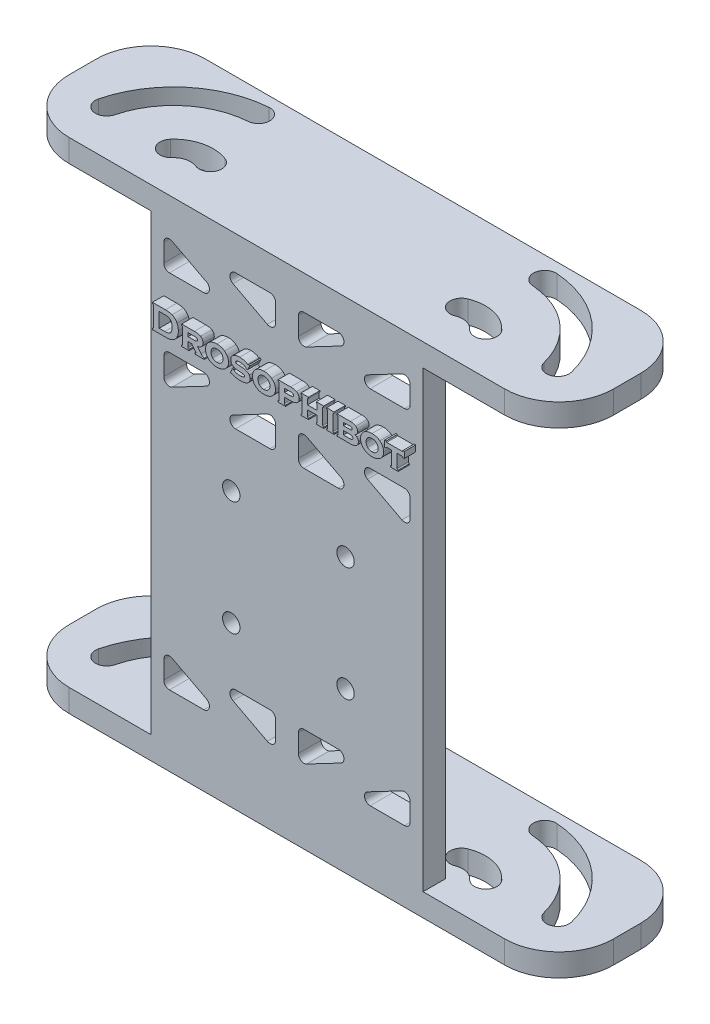
from build123d import *

# Parameters (mm, degrees)
BOSS_EXTRUDE1_DEPTH   = 3.175
SKETCH2_W             = 38.1
SKETCH2_H             = 3.175
BOSS_EXTRUDE2_DEPTH   = 63.5
CUT_EXTRUDE1_DEPTH    = 75.663147704
FILLET1_R             = 7.62
F_2_CLEARANCE_HOLE2_D = 2.4384
FILLET1_OF_MIRROR1_R  = 7.62
BOSS_EXTRUDE3_DEPTH   = 1.5875
CUT_EXTRUDE2_DEPTH    = 3.175


with BuildPart() as part:
    # Sketch1 → Boss-Extrude1 (new body)
    with BuildSketch(Plane(origin=(0, 0, 0), x_dir=(1, 0, 0), z_dir=(0, 1, 0))):
        Polygon((-38.1, 9.525), (0, 9.525), (38.1, 9.525), (38.1, -9.525), (-38.1, -9.525), align=None)
    boss_extrude1 = extrude(amount=BOSS_EXTRUDE1_DEPTH)

    # Sketch2 → Boss-Extrude2 (add)
    with BuildSketch(Plane(origin=(0, 3.175, 0), x_dir=(1, 0, 0), z_dir=(0, 1, 0))):
        with Locations((0, -7.9375)):
            Rectangle(SKETCH2_W, SKETCH2_H)
    extrude(amount=BOSS_EXTRUDE2_DEPTH)

    # Sketch6 → Cut-Extrude1 (cut, through all)
    with BuildSketch(Plane(origin=(0, 3.175, 0), x_dir=(1, 0, 0), z_dir=(0, 1, 0))):
        with BuildLine():
            ThreePointArc((-20.158139463, 8.116433777), (-28.391214829, 4.751683872), (-33.113993118, -2.784922601))
            ThreePointArc((-33.113993118, -2.784922601), (-31.965241133, -4.713829384), (-30.03633435, -3.565077399))
            ThreePointArc((-30.03633435, -3.565077399), (-26.347053439, 2.322274641), (-19.915642535, 4.950707914))
            ThreePointArc((-19.915642535, 4.950707914), (-18.454028067, 6.654819309), (-20.158139463, 8.116433777))
        make_face()
        with BuildLine():
            ThreePointArc((-16.980295432, -1.193621711), (-20.312174356, -0.939008413), (-23.187529976, -2.641528649))
            ThreePointArc((-23.187529976, -2.641528649), (-23.064941797, -4.883243314), (-20.823227132, -4.760655135))
            ThreePointArc((-20.823227132, -4.760655135), (-19.590931867, -4.031003605), (-18.162983757, -4.14012359))
            ThreePointArc((-18.162983757, -4.14012359), (-16.098388655, -3.258216813), (-16.980295432, -1.193621711))
        make_face()
        with BuildLine():
            ThreePointArc((16.980295432, -1.193621711), (20.312174356, -0.939008413), (23.187529976, -2.641528649))
            ThreePointArc((23.187529976, -2.641528649), (23.064941797, -4.883243314), (20.823227132, -4.760655135))
            ThreePointArc((20.823227132, -4.760655135), (19.590931867, -4.031003605), (18.162983757, -4.14012359))
            ThreePointArc((18.162983757, -4.14012359), (16.098388655, -3.258216813), (16.980295432, -1.193621711))
        make_face()
        with BuildLine():
            ThreePointArc((20.158139463, 8.116433777), (28.391214829, 4.751683872), (33.113993118, -2.784922601))
            ThreePointArc((33.113993118, -2.784922601), (31.965241133, -4.713829384), (30.03633435, -3.565077399))
            ThreePointArc((30.03633435, -3.565077399), (26.347053439, 2.322274641), (19.915642535, 4.950707914))
            ThreePointArc((19.915642535, 4.950707914), (18.454028067, 6.654819309), (20.158139463, 8.116433777))
        make_face()
    cut_extrude1 = extrude(amount=-CUT_EXTRUDE1_DEPTH, mode=Mode.SUBTRACT)

    # Fillet1
    fillet1_edges = [part.edges().sort_by_distance(p)[0] for p in [
        (38.1, 1.5875, 9.525),
        (-38.1, 1.5875, 9.525),
        (-38.1, 1.5875, -9.525),
        (38.1, 1.5875, -9.525),
    ]]
    fillet(fillet1_edges, radius=FILLET1_R)

    # #2 Clearance Hole2 (through all)
    with Locations(Plane(origin=(0, 0, 6.35), x_dir=(-1, 0, 0), z_dir=(0, 0, -1))):
        with Locations((7.799679918, 38.35), (-8.200320082, 22.35), (7.799679918, 22.35), (-8.200320082, 38.35)):
            Hole(F_2_CLEARANCE_HOLE2_D / 2)

    # Mirror1: Boss-Extrude1, Cut-Extrude1 across plane
    add(boss_extrude1.mirror(Plane.ZX.offset(34.925)))
    add(cut_extrude1.mirror(Plane.ZX.offset(34.925)), mode=Mode.SUBTRACT)

    # Fillet1 of Mirror1
    fillet1_of_mirror1_edges = [part.edges().sort_by_distance(p)[0] for p in [
        (38.1, 68.2625, 9.525),
        (-38.1, 68.2625, 9.525),
        (-38.1, 68.2625, -9.525),
        (38.1, 68.2625, -9.525),
    ]]
    fillet(fillet1_of_mirror1_edges, radius=FILLET1_OF_MIRROR1_R)

    # Sketch9 → Boss-Extrude3 (add)
    # profile 1 of 11: a face of its own
    with BuildSketch(Plane.XY.offset(9.525)):
        with BuildLine():
            Line((-17.109109761, 54.281632638), (-17.109109761, 56.976883952))
            add(Edge.make_bspline(
                [(-17.109109761, 56.976883952), (-17.10968308, 56.993452081), (-17.110668499, 57.021929343), (-17.123630294, 57.056436715), (-17.145715688, 57.073875972), (-17.170283831, 57.087164843), (-17.204704041, 57.099892314), (-17.23065859, 57.108678094), (-17.245076196, 57.113558546)],
                knots=[0, 0, 0, 0, 1.390022291, 2.38916702, 2.935671537, 3.705255179, 4.725282125, 6, 6, 6, 6], degree=3))
            Line((-17.245076196, 57.113558546), (-17.245076196, 57.28351659))
            Line((-17.245076196, 57.28351659), (-15.431482235, 57.28351659))
            add(Edge.make_bspline(
                [(-15.431482235, 57.28351659), (-15.382378755, 57.283105437), (-15.287196551, 57.282308458), (-15.148961107, 57.276285542), (-15.019613215, 57.26441886), (-14.898913412, 57.250554255), (-14.787294067, 57.23012881), (-14.684420371, 57.207473953), (-14.590387535, 57.179356556), (-14.531970979, 57.155988684), (-14.503794578, 57.14471752)],
                knots=[0, 0, 0, 0, 1.248589014, 2.420265431, 3.516880408, 4.55096862, 5.508184297, 6.400759175, 7.228628757, 8, 8, 8, 8], degree=3))
            add(Edge.make_bspline(
                [(-14.503794578, 57.14471752), (-14.464020868, 57.126286788), (-14.385622055, 57.089957575), (-14.275836321, 57.024388815), (-14.174677844, 56.951627084), (-14.081324328, 56.872513667), (-13.997336843, 56.784744778), (-13.92230112, 56.689458326), (-13.854761038, 56.58717201), (-13.817825044, 56.513911631), (-13.799176854, 56.476924039)],
                knots=[0, 0, 0, 0, 1.059350134, 2.0881078, 3.085988045, 4.069681294, 5.042519022, 6.017681175, 6.999169779, 8, 8, 8, 8], degree=3))
            add(Edge.make_bspline(
                [(-13.799176854, 56.476924039), (-13.784516205, 56.445500823), (-13.755070968, 56.382388746), (-13.719760743, 56.283463099), (-13.688279646, 56.1822349), (-13.662603505, 56.078006241), (-13.64386561, 55.970508539), (-13.629580728, 55.860190072), (-13.620884411, 55.746480325), (-13.619836135, 55.669638428), (-13.619304591, 55.630674612)],
                knots=[0, 0, 0, 0, 0.953366277, 1.914792105, 2.886317703, 3.869062711, 4.865125376, 5.886395046, 6.928265475, 8, 8, 8, 8], degree=3))
            add(Edge.make_bspline(
                [(-13.619304591, 55.630674612), (-13.620933823, 55.562620793), (-13.624107511, 55.430054339), (-13.648852265, 55.236818704), (-13.691659556, 55.055785291), (-13.749289342, 54.885485753), (-13.825593482, 54.72759493), (-13.918470107, 54.581273981), (-14.027505741, 54.44579307), (-14.113011556, 54.367238265), (-14.156088747, 54.327662941)],
                knots=[0, 0, 0, 0, 1.121758256, 2.18514579, 3.204608397, 4.184245267, 5.143298004, 6.087967556, 7.036732353, 8, 8, 8, 8], degree=3))
            add(Edge.make_bspline(
                [(-14.156088747, 54.327662941), (-14.192437933, 54.298100467), (-14.265866774, 54.238381434), (-14.390780926, 54.166178107), (-14.525984966, 54.104991022), (-14.647198705, 54.064494352), (-14.750524224, 54.038540894), (-14.833778377, 54.021806406), (-14.921515634, 54.006499332), (-15.014489558, 53.995736089), (-15.112002544, 53.986585328), (-15.214210073, 53.97910259), (-15.321226481, 53.976032704), (-15.394185075, 53.975349342), (-15.431482235, 53.975)],
                knots=[0, 0, 0, 0, 1.245389248, 2.515805668, 3.826160027, 5.191124332, 5.91037887, 6.660791241, 7.450971463, 8.280155195, 9.151041957, 10.057966744, 11.007213243, 12, 12, 12, 12], degree=3))
            Line((-15.431482235, 53.975), (-17.245076196, 53.975))
            Line((-17.245076196, 53.975), (-17.245076196, 54.144249885))
            add(Edge.make_bspline(
                [(-17.245076196, 54.144249885), (-17.230659019, 54.149130459), (-17.204705244, 54.15791646), (-17.170280489, 54.170642638), (-17.145723803, 54.183934767), (-17.123430328, 54.201499338), (-17.11084206, 54.236442373), (-17.109743896, 54.265090046), (-17.109109761, 54.281632638)],
                knots=[0, 0, 0, 0, 1.270903566, 2.287878308, 3.055159144, 3.600028367, 4.614137041, 6, 6, 6, 6], degree=3))
        make_face()
        with BuildLine():
            Line((-16.29331115, 54.609510031), (-15.512212306, 54.609510031))
            add(Edge.make_bspline(
                [(-15.512212306, 54.609510031), (-15.479389869, 54.609621534), (-15.41605096, 54.609836708), (-15.324182902, 54.616003962), (-15.238900066, 54.624289286), (-15.159548916, 54.635162286), (-15.087038511, 54.650874211), (-15.020683385, 54.669099688), (-14.960715561, 54.690630005), (-14.9242836, 54.709007217), (-14.906736774, 54.717858284)],
                knots=[0, 0, 0, 0, 1.268636097, 2.448143179, 3.557798187, 4.581246333, 5.542419901, 6.423675183, 7.240790318, 8, 8, 8, 8], degree=3))
            add(Edge.make_bspline(
                [(-14.906736774, 54.717858284), (-14.872671875, 54.738482848), (-14.805234131, 54.779312974), (-14.717614943, 54.860047235), (-14.643592183, 54.954387078), (-14.582686673, 55.062722135), (-14.537085688, 55.185483533), (-14.504387413, 55.321471703), (-14.483234779, 55.471390911), (-14.481388463, 55.57606972), (-14.480425347, 55.630674612)],
                knots=[0, 0, 0, 0, 0.899459705, 1.780646228, 2.678438427, 3.604185232, 4.581524582, 5.632379706, 6.764949168, 8, 8, 8, 8], degree=3))
            add(Edge.make_bspline(
                [(-14.480425347, 55.630674612), (-14.481089077, 55.670588069), (-14.482379762, 55.748203477), (-14.492819639, 55.861184969), (-14.511438669, 55.966641815), (-14.535686108, 56.06525377), (-14.568551172, 56.156206789), (-14.607913742, 56.240338732), (-14.655534659, 56.316724701), (-14.692852069, 56.362334465), (-14.711285024, 56.384863432)],
                knots=[0, 0, 0, 0, 1.188044483, 2.310262366, 3.373072149, 4.37346866, 5.329213301, 6.247007949, 7.134108642, 8, 8, 8, 8], degree=3))
            add(Edge.make_bspline(
                [(-14.711285024, 56.384863432), (-14.733165527, 56.407403748), (-14.776541217, 56.452087443), (-14.85120326, 56.508701665), (-14.933284785, 56.553917046), (-15.023366511, 56.590165525), (-15.124661811, 56.617102905), (-15.239975671, 56.635305795), (-15.370784448, 56.647721881), (-15.46331618, 56.648562405), (-15.512212306, 56.649006559)],
                knots=[0, 0, 0, 0, 0.864673378, 1.714119793, 2.570114627, 3.439715237, 4.383230238, 5.451422159, 6.653266496, 8, 8, 8, 8], degree=3))
            Line((-15.512212306, 56.649006559), (-16.29331115, 56.649006559))
            Line((-16.29331115, 56.649006559), (-16.29331115, 54.609510031))
        make_face(mode=Mode.SUBTRACT)
    # profile 2 of 11: a face of its own
    with BuildSketch(Plane.XY.offset(9.525)):
        with BuildLine():
            Line((-12.259640239, 55.017409336), (-12.259640239, 54.27596737))
            add(Edge.make_bspline(
                [(-12.259640239, 54.27596737), (-12.259358593, 54.26581072), (-12.258845622, 54.247312118), (-12.255572219, 54.222255471), (-12.249989021, 54.202687786), (-12.241951967, 54.185978157), (-12.224444738, 54.173857095), (-12.199722183, 54.161905323), (-12.165307926, 54.14739522), (-12.138633747, 54.139028216), (-12.123673804, 54.134335666)],
                knots=[0, 0, 0, 0, 1.101055757, 2.005385072, 2.725676417, 3.30951187, 3.964635889, 4.971329498, 6.30140087, 8, 8, 8, 8], degree=3))
            Line((-12.123673804, 54.134335666), (-12.123673804, 53.975))
            Line((-12.123673804, 53.975), (-13.16608314, 53.975))
            Line((-13.16608314, 53.975), (-13.16608314, 54.144958044))
            add(Edge.make_bspline(
                [(-13.16608314, 54.144958044), (-13.152086311, 54.149239574), (-13.126641799, 54.157022869), (-13.093332149, 54.170211065), (-13.068515104, 54.183085374), (-13.046539083, 54.202135731), (-13.03262795, 54.236337372), (-13.031012873, 54.265013039), (-13.030116705, 54.280924479)],
                knots=[0, 0, 0, 0, 1.233294171, 2.241976844, 3.016939525, 3.580415213, 4.657430354, 6, 6, 6, 6], degree=3))
            Line((-13.030116705, 54.280924479), (-13.030116705, 56.388404225))
            add(Edge.make_bspline(
                [(-13.030116705, 56.388404225), (-13.030573549, 56.404152479), (-13.031384396, 56.432103894), (-13.04640496, 56.464796553), (-13.067933109, 56.483382026), (-13.092503524, 56.497151578), (-13.12633197, 56.510842402), (-13.151882598, 56.51999306), (-13.16608314, 56.525078818)],
                knots=[0, 0, 0, 0, 1.324974095, 2.351682859, 2.917038351, 3.704517797, 4.72421557, 6, 6, 6, 6], degree=3))
            Line((-13.16608314, 56.525078818), (-13.16608314, 56.694328704))
            Line((-13.16608314, 56.694328704), (-11.384356313, 56.694328704))
            add(Edge.make_bspline(
                [(-11.384356313, 56.694328704), (-11.329347584, 56.694033914), (-11.225887086, 56.693479472), (-11.080105993, 56.686511042), (-10.953369291, 56.67500818), (-10.843226349, 56.658274388), (-10.746318689, 56.634909061), (-10.65766579, 56.60722223), (-10.576672635, 56.57101175), (-10.526996638, 56.541592788), (-10.50269896, 56.527203294)],
                knots=[0, 0, 0, 0, 1.45130304, 2.72961292, 3.849486608, 4.807909189, 5.665962542, 6.477453849, 7.255287494, 8, 8, 8, 8], degree=3))
            add(Edge.make_bspline(
                [(-10.50269896, 56.527203294), (-10.476452637, 56.508735924), (-10.425054468, 56.472571275), (-10.357816808, 56.407965054), (-10.301253911, 56.336392463), (-10.25493107, 56.257737178), (-10.218418035, 56.172114314), (-10.193468951, 56.079361621), (-10.177213908, 55.980131985), (-10.175634332, 55.91164525), (-10.174821566, 55.876405617)],
                knots=[0, 0, 0, 0, 1.009371131, 1.976651319, 2.923876541, 3.873548173, 4.842682784, 5.845299254, 6.891305539, 8, 8, 8, 8], degree=3))
            add(Edge.make_bspline(
                [(-10.174821566, 55.876405617), (-10.175267073, 55.849700389), (-10.176137266, 55.797537903), (-10.185788157, 55.72153579), (-10.200351648, 55.649370145), (-10.221710194, 55.581358496), (-10.248664101, 55.517296019), (-10.281272849, 55.457235007), (-10.320734082, 55.401612831), (-10.366087519, 55.349907214), (-10.417282214, 55.302440299), (-10.473693547, 55.259200343), (-10.534759867, 55.219203486), (-10.601655364, 55.183782234), (-10.674122829, 55.15298516), (-10.751538023, 55.125060781), (-10.834482476, 55.101919803), (-10.89188038, 55.089577256), (-10.921220643, 55.083268078)],
                knots=[0, 0, 0, 0, 1.068355676, 2.08678567, 3.061499488, 4.011819567, 4.934881223, 5.839774827, 6.741555341, 7.658844318, 8.588123246, 9.531182029, 10.500845244, 11.506839299, 12.556437494, 13.650268682, 14.798880622, 16, 16, 16, 16], degree=3))
            Line((-10.921220643, 55.083268078), (-10.427634157, 54.465045693))
            add(Edge.make_bspline(
                [(-10.427634157, 54.465045693), (-10.404704109, 54.436083155), (-10.362860828, 54.383231644), (-10.30322646, 54.313620695), (-10.254357708, 54.260228758), (-10.212259636, 54.220688977), (-10.168322434, 54.193641223), (-10.118272626, 54.172942473), (-10.059162258, 54.155254221), (-10.016289545, 54.147140356), (-9.993532986, 54.142833568)],
                knots=[0, 0, 0, 0, 1.584341913, 2.891143797, 3.929827471, 4.689904741, 5.358503085, 6.129559669, 7.00718237, 8, 8, 8, 8], degree=3))
            Line((-9.993532986, 54.142833568), (-9.993532986, 53.975))
            Line((-9.993532986, 53.975), (-11.285922279, 53.975))
            Line((-11.285922279, 53.975), (-11.285922279, 54.146374361))
            add(Edge.make_bspline(
                [(-11.285922279, 54.146374361), (-11.267481296, 54.151087527), (-11.235099426, 54.15936372), (-11.196726165, 54.175666589), (-11.168098747, 54.189393721), (-11.162693322, 54.20428269), (-11.160578221, 54.210108628)],
                knots=[0, 0, 0, 0, 1.556662971, 2.733458377, 3.504412147, 4, 4, 4, 4], degree=3))
            add(Edge.make_bspline(
                [(-11.160578221, 54.210108628), (-11.161681922, 54.216590506), (-11.164445376, 54.232819883), (-11.180219554, 54.258717611), (-11.201481386, 54.292594618), (-11.220256767, 54.3165056), (-11.230685915, 54.329787417)],
                knots=[0, 0, 0, 0, 0.559346848, 1.400497002, 2.556055858, 4, 4, 4, 4], degree=3))
            Line((-11.230685915, 54.329787417), (-11.742684522, 55.017409336))
            Line((-11.742684522, 55.017409336), (-12.259640239, 55.017409336))
        make_face()
        with BuildLine():
            Line((-12.259640239, 55.606597222), (-11.377274728, 55.606597222))
            add(Edge.make_bspline(
                [(-11.377274728, 55.606597222), (-11.34420404, 55.607115551), (-11.282679814, 55.608079841), (-11.197688201, 55.615549986), (-11.126752154, 55.627664602), (-11.086080184, 55.642446421), (-11.067809456, 55.649086733)],
                knots=[0, 0, 0, 0, 1.262952983, 2.349579301, 3.258595352, 4, 4, 4, 4], degree=3))
            add(Edge.make_bspline(
                [(-11.067809456, 55.649086733), (-11.048987804, 55.658753506), (-11.012424865, 55.677532178), (-10.972284756, 55.72626098), (-10.949039875, 55.787360431), (-10.946599566, 55.832039529), (-10.945298032, 55.85586902)],
                knots=[0, 0, 0, 0, 0.98379625, 1.911122552, 2.885902148, 4, 4, 4, 4], degree=3))
            add(Edge.make_bspline(
                [(-10.945298032, 55.85586902), (-10.946299543, 55.877448618), (-10.948171586, 55.91778562), (-10.964111331, 55.9738764), (-10.993475901, 56.018777393), (-11.027287059, 56.047161387), (-11.060319691, 56.06365637), (-11.090461121, 56.074988517), (-11.125534491, 56.084648371), (-11.165997123, 56.092569125), (-11.211486149, 56.09771294), (-11.262253894, 56.102003705), (-11.317991126, 56.104968683), (-11.356970172, 56.105081862), (-11.377274728, 56.105140818)],
                knots=[0, 0, 0, 0, 1.352435424, 2.527998436, 3.607939354, 4.669456881, 5.252135492, 5.917529754, 6.686241136, 7.53115463, 8.500729589, 9.555619039, 10.726698717, 12, 12, 12, 12], degree=3))
            Line((-11.377274728, 56.105140818), (-12.259640239, 56.105140818))
            Line((-12.259640239, 56.105140818), (-12.259640239, 55.606597222))
        make_face(mode=Mode.SUBTRACT)
    # profile 3 of 11: a face of its own
    with BuildSketch(Plane.XY.offset(9.525)):
        with BuildLine():
            add(Edge.make_bspline(
                [(-8.23021828, 56.73894269), (-8.175657971, 56.738017304), (-8.068923222, 56.736206997), (-7.912430006, 56.721263625), (-7.763377405, 56.695665779), (-7.621499925, 56.660852591), (-7.487569855, 56.614308255), (-7.36090068, 56.558314754), (-7.241287839, 56.492124516), (-7.167741991, 56.439411908), (-7.131156262, 56.413189773)],
                knots=[0, 0, 0, 0, 1.121835071, 2.194613413, 3.228865766, 4.229584865, 5.195180428, 6.140504067, 7.074984972, 8, 8, 8, 8], degree=3))
            add(Edge.make_bspline(
                [(-7.131156262, 56.413189773), (-7.088293693, 56.378490585), (-7.004253721, 56.310456428), (-6.894441989, 56.193790086), (-6.801862406, 56.068312969), (-6.725062704, 55.93462437), (-6.667125196, 55.79116123), (-6.624152027, 55.639838171), (-6.599250553, 55.479242112), (-6.596020478, 55.369449133), (-6.594372106, 55.313419596)],
                knots=[0, 0, 0, 0, 1.040172472, 2.039449965, 3.014497543, 3.978453793, 4.941699065, 5.927813909, 6.942522317, 8, 8, 8, 8], degree=3))
            add(Edge.make_bspline(
                [(-6.594372106, 55.313419596), (-6.596031502, 55.260689936), (-6.599294816, 55.156993493), (-6.624304073, 55.004861434), (-6.667386081, 54.860665442), (-6.725254118, 54.723057404), (-6.802275139, 54.594265451), (-6.895101166, 54.472434055), (-7.004447903, 54.357378548), (-7.08830772, 54.289906111), (-7.131156262, 54.255430773)],
                knots=[0, 0, 0, 0, 1.026610068, 2.018898139, 2.991993491, 3.951739343, 4.918308716, 5.905761353, 6.929939572, 8, 8, 8, 8], degree=3))
            add(Edge.make_bspline(
                [(-7.131156262, 54.255430773), (-7.167232938, 54.229153698), (-7.239646156, 54.17641027), (-7.358417292, 54.111014289), (-7.484175965, 54.054812771), (-7.617566256, 54.008768774), (-7.758607485, 53.973469671), (-7.907045031, 53.948270245), (-8.06320978, 53.932164838), (-8.169984176, 53.930518992), (-8.224553012, 53.929677855)],
                knots=[0, 0, 0, 0, 0.921292381, 1.849220992, 2.794480136, 3.764560754, 4.760468581, 5.794718587, 6.872954164, 8, 8, 8, 8], degree=3))
            add(Edge.make_bspline(
                [(-8.224553012, 53.929677855), (-8.27699942, 53.930518861), (-8.379773728, 53.932166902), (-8.530505326, 53.948370113), (-8.674467437, 53.973525328), (-8.811956633, 54.008875271), (-8.942509633, 54.054916182), (-9.066247929, 54.111335722), (-9.184103499, 54.176575939), (-9.256369672, 54.229168488), (-9.292456055, 54.255430773)],
                knots=[0, 0, 0, 0, 1.106854001, 2.168997964, 3.196402754, 4.189941206, 5.162410167, 6.114699944, 7.058568413, 8, 8, 8, 8], degree=3))
            add(Edge.make_bspline(
                [(-9.292456055, 54.255430773), (-9.333928678, 54.288933897), (-9.41545726, 54.354795712), (-9.521088156, 54.468670319), (-9.611570973, 54.590413581), (-9.684734804, 54.722019844), (-9.742926625, 54.862264869), (-9.782438899, 55.012152254), (-9.808486219, 55.17040598), (-9.81097273, 55.279083467), (-9.812244406, 55.334664352)],
                knots=[0, 0, 0, 0, 1.027025022, 2.018967835, 2.985891614, 3.945803306, 4.915434376, 5.905986968, 6.929059722, 8, 8, 8, 8], degree=3))
            add(Edge.make_bspline(
                [(-9.812244406, 55.334664352), (-9.810969347, 55.390716082), (-9.808475858, 55.500330108), (-9.782503747, 55.659770552), (-9.743059111, 55.810409154), (-9.684704438, 55.950833929), (-9.611740376, 56.082336871), (-9.521249753, 56.203448425), (-9.415376081, 56.315960702), (-9.333914393, 56.380865765), (-9.292456055, 56.413897931)],
                knots=[0, 0, 0, 0, 1.079180921, 2.110432006, 3.104591937, 4.073456394, 5.032609158, 5.995110362, 6.979650513, 8, 8, 8, 8], degree=3))
            add(Edge.make_bspline(
                [(-9.292456055, 56.413897931), (-9.256303279, 56.439362395), (-9.183669665, 56.490522398), (-9.066268431, 56.555229532), (-8.942675457, 56.610799052), (-8.81244144, 56.655908669), (-8.676168276, 56.692261942), (-8.533368272, 56.718169451), (-8.38404037, 56.734876462), (-8.282194843, 56.73756871), (-8.23021828, 56.73894269)],
                knots=[0, 0, 0, 0, 0.938923588, 1.886367322, 2.842676174, 3.814961017, 4.811265976, 5.836253256, 6.895738265, 8, 8, 8, 8], degree=3))
        make_face()
        with BuildLine():
            add(Edge.make_bspline(
                [(-8.228093804, 56.150462963), (-8.257414326, 56.149952898), (-8.314901817, 56.148952835), (-8.399214751, 56.136020752), (-8.479865352, 56.117247101), (-8.55746317, 56.090976091), (-8.63097788, 56.055915456), (-8.701572432, 56.013994186), (-8.768690364, 55.964326072), (-8.809403065, 55.925711048), (-8.830028543, 55.906148275)],
                knots=[0, 0, 0, 0, 1.053498601, 2.06554956, 3.060074501, 4.029203748, 5.005150106, 5.983493329, 6.978416725, 8, 8, 8, 8], degree=3))
            add(Edge.make_bspline(
                [(-8.830028543, 55.906148275), (-8.846956652, 55.887840129), (-8.88066407, 55.851384769), (-8.923903765, 55.790783307), (-8.960372144, 55.725674874), (-8.989961086, 55.65602759), (-9.01360244, 55.582129282), (-9.029582055, 55.503523197), (-9.039701436, 55.420615344), (-9.041069139, 55.3637292), (-9.04176794, 55.334664352)],
                knots=[0, 0, 0, 0, 0.955712872, 1.903024941, 2.847563538, 3.81296373, 4.800902544, 5.818438654, 6.88537446, 8, 8, 8, 8], degree=3))
            add(Edge.make_bspline(
                [(-9.04176794, 55.334664352), (-9.041080906, 55.305598408), (-9.039741776, 55.248944546), (-9.029520916, 55.166282777), (-9.01357926, 55.087919325), (-8.990129076, 55.014171988), (-8.960180887, 54.944917212), (-8.923926404, 54.87995199), (-8.880658345, 54.819362711), (-8.846954738, 54.782905713), (-8.830028543, 54.764596746)],
                knots=[0, 0, 0, 0, 1.117041926, 2.177281406, 3.197023422, 4.187103979, 5.146263256, 6.092849509, 7.042215247, 8, 8, 8, 8], degree=3))
            add(Edge.make_bspline(
                [(-8.830028543, 54.764596746), (-8.80936227, 54.745087963), (-8.768466005, 54.706482243), (-8.701808494, 54.655966412), (-8.630955353, 54.614139501), (-8.556967358, 54.578909767), (-8.478975057, 54.552160928), (-8.397345609, 54.53316085), (-8.312292543, 54.520433065), (-8.254106775, 54.519393671), (-8.224553012, 54.518865741)],
                knots=[0, 0, 0, 0, 1.015339027, 2.009243402, 2.981606673, 3.95158773, 4.933494559, 5.921940642, 6.94451035, 8, 8, 8, 8], degree=3))
            add(Edge.make_bspline(
                [(-8.224553012, 54.518865741), (-8.192875967, 54.5193811), (-8.130695778, 54.52039272), (-8.039781541, 54.533219067), (-7.953113617, 54.551838933), (-7.87113461, 54.578765175), (-7.794155494, 54.614157672), (-7.720689743, 54.655567759), (-7.652475213, 54.706086588), (-7.611379455, 54.745042528), (-7.590751139, 54.764596746)],
                knots=[0, 0, 0, 0, 1.08761812, 2.134930866, 3.148405058, 4.130763017, 5.092683965, 6.055459421, 7.02392366, 8, 8, 8, 8], degree=3))
            add(Edge.make_bspline(
                [(-7.590751139, 54.764596746), (-7.572638202, 54.783597309), (-7.536824032, 54.821166555), (-7.490869256, 54.883010693), (-7.452124375, 54.948356876), (-7.420324804, 55.016924525), (-7.395415549, 55.088815638), (-7.377606605, 55.163996533), (-7.366834151, 55.242525588), (-7.365516427, 55.296153766), (-7.364848573, 55.323333816)],
                knots=[0, 0, 0, 0, 1.016686804, 2.010264544, 2.978368803, 3.956665045, 4.934618987, 5.922112506, 6.946876678, 8, 8, 8, 8], degree=3))
            add(Edge.make_bspline(
                [(-7.364848573, 55.323333816), (-7.365489382, 55.352873547), (-7.366739495, 55.410500724), (-7.377662303, 55.494898119), (-7.395350573, 55.574705877), (-7.419003915, 55.650535023), (-7.4515709, 55.721243268), (-7.490434292, 55.787655042), (-7.535879403, 55.850441302), (-7.571857456, 55.887444552), (-7.590042981, 55.906148275)],
                knots=[0, 0, 0, 0, 1.103232844, 2.152226556, 3.172849105, 4.154553452, 5.113576288, 6.07401723, 7.026489593, 8, 8, 8, 8], degree=3))
            add(Edge.make_bspline(
                [(-7.590042981, 55.906148275), (-7.610891985, 55.925278685), (-7.652465321, 55.963425109), (-7.72177166, 56.011922108), (-7.794920748, 56.054380295), (-7.873317007, 56.088107864), (-7.95580172, 56.115109941), (-8.042509749, 56.135020137), (-8.133812632, 56.147128924), (-8.196190221, 56.149334765), (-8.228093804, 56.150462963)],
                knots=[0, 0, 0, 0, 0.968635487, 1.931478721, 2.891600131, 3.862360894, 4.84969421, 5.862153196, 6.906578855, 8, 8, 8, 8], degree=3))
        make_face(mode=Mode.SUBTRACT)
    # profile 4 of 11: a face of its own
    with BuildSketch(Plane.XY.offset(9.525)):
        with BuildLine():
            Line((-3.603110532, 56.399026602), (-3.959314266, 55.723443377))
            Line((-3.959314266, 55.723443377), (-4.110860189, 55.771598157))
            add(Edge.make_bspline(
                [(-4.110860189, 55.771598157), (-4.111235944, 55.784371225), (-4.111937353, 55.808214285), (-4.117743123, 55.840980561), (-4.128903155, 55.86762988), (-4.140274995, 55.880873255), (-4.145559956, 55.887027995)],
                knots=[0, 0, 0, 0, 1.239332454, 2.313420581, 3.216177334, 4, 4, 4, 4], degree=3))
            add(Edge.make_bspline(
                [(-4.145559956, 55.887027995), (-4.168459349, 55.90564042), (-4.217165837, 55.945228626), (-4.305053411, 55.993832366), (-4.408097033, 56.03820043), (-4.524695786, 56.076429935), (-4.648897196, 56.10963333), (-4.776591802, 56.132599268), (-4.904825206, 56.147509724), (-4.990588077, 56.149476697), (-5.033590736, 56.150462963)],
                knots=[0, 0, 0, 0, 0.750155756, 1.595564213, 2.545791327, 3.604473088, 4.7168189, 5.816737702, 6.905282879, 8, 8, 8, 8], degree=3))
            add(Edge.make_bspline(
                [(-5.033590736, 56.150462963), (-5.066675898, 56.149873239), (-5.131867426, 56.148711238), (-5.227258311, 56.136866295), (-5.318634761, 56.119039421), (-5.376717217, 56.100722844), (-5.405373957, 56.091685806)],
                knots=[0, 0, 0, 0, 1.049655208, 2.068257304, 3.046916193, 4, 4, 4, 4], degree=3))
            add(Edge.make_bspline(
                [(-5.405373957, 56.091685806), (-5.420626193, 56.08613273), (-5.449680601, 56.075554522), (-5.489042989, 56.054970047), (-5.521991901, 56.031376392), (-5.549252042, 56.005742972), (-5.571329584, 55.977921457), (-5.58603319, 55.946846041), (-5.596008207, 55.913607206), (-5.596852571, 55.890408605), (-5.597284915, 55.878530093)],
                knots=[0, 0, 0, 0, 1.264020392, 2.40786757, 3.44934796, 4.412317082, 5.317496093, 6.197844984, 7.07723227, 8, 8, 8, 8], degree=3))
            add(Edge.make_bspline(
                [(-5.597284915, 55.878530093), (-5.596311924, 55.864407918), (-5.594432587, 55.837130872), (-5.576492531, 55.80000197), (-5.54663222, 55.770806974), (-5.513079055, 55.753682214), (-5.478915817, 55.742867636), (-5.444912, 55.735585118), (-5.403833598, 55.727773635), (-5.355409135, 55.720084274), (-5.299730743, 55.712187794), (-5.236622733, 55.705482839), (-5.166327432, 55.698074972), (-5.116929212, 55.694280072), (-5.090951576, 55.692284403)],
                knots=[0, 0, 0, 0, 0.861920288, 1.664803078, 2.46323628, 3.382911663, 3.946002484, 4.658879897, 5.51347495, 6.510663061, 7.665327566, 8.961829717, 10.402280797, 12, 12, 12, 12], degree=3))
            Line((-5.090951576, 55.692284403), (-4.723417306, 55.665374379))
            add(Edge.make_bspline(
                [(-4.723417306, 55.665374379), (-4.681593042, 55.662004657), (-4.600594746, 55.655478739), (-4.483543766, 55.639332105), (-4.374320744, 55.62127198), (-4.272956392, 55.599810148), (-4.180235126, 55.573303565), (-4.095229331, 55.544675834), (-4.018574587, 55.511508873), (-3.971419703, 55.48583687), (-3.948691889, 55.473463421)],
                knots=[0, 0, 0, 0, 1.251509832, 2.423716672, 3.523526334, 4.553917576, 5.512504576, 6.398841474, 7.228270097, 8, 8, 8, 8], degree=3))
            add(Edge.make_bspline(
                [(-3.948691889, 55.473463421), (-3.920892473, 55.456112946), (-3.867296206, 55.422661857), (-3.796477585, 55.364747109), (-3.735210591, 55.304580281), (-3.703081513, 55.259617862), (-3.687381396, 55.237646635)],
                knots=[0, 0, 0, 0, 1.107058485, 2.134368728, 3.088345169, 4, 4, 4, 4], degree=3))
            add(Edge.make_bspline(
                [(-3.687381396, 55.237646635), (-3.667439237, 55.204895953), (-3.628331502, 55.140669955), (-3.588477765, 55.036417419), (-3.561820507, 54.929999243), (-3.559133419, 54.857526119), (-3.557788387, 54.821249427)],
                knots=[0, 0, 0, 0, 1.038584524, 2.036724793, 3.01727531, 4, 4, 4, 4], degree=3))
            add(Edge.make_bspline(
                [(-3.557788387, 54.821249427), (-3.55905211, 54.787890377), (-3.561536732, 54.722302732), (-3.580050097, 54.626204537), (-3.612708009, 54.535866381), (-3.656036116, 54.449340927), (-3.713746746, 54.368612868), (-3.782597094, 54.291581896), (-3.86508489, 54.220287289), (-3.926749893, 54.178555454), (-3.958606108, 54.156996739)],
                knots=[0, 0, 0, 0, 0.985578598, 1.937758426, 2.87764491, 3.816676751, 4.788182391, 5.800816198, 6.863899019, 8, 8, 8, 8], degree=3))
            add(Edge.make_bspline(
                [(-3.958606108, 54.156996739), (-3.988940834, 54.138629262), (-4.051024371, 54.10103809), (-4.153013988, 54.056178358), (-4.262240019, 54.015835624), (-4.380416807, 53.984481326), (-4.506523912, 53.95981277), (-4.641104117, 53.942290207), (-4.783907801, 53.931591817), (-4.882025507, 53.9303265), (-4.932324068, 53.929677855)],
                knots=[0, 0, 0, 0, 0.839222278, 1.717565764, 2.633855715, 3.59558099, 4.609963955, 5.676002519, 6.80863776, 8, 8, 8, 8], degree=3))
            add(Edge.make_bspline(
                [(-4.932324068, 53.929677855), (-4.982161035, 53.930464936), (-5.081290079, 53.932030492), (-5.229238726, 53.945562004), (-5.376106251, 53.965792537), (-5.52178696, 53.994805768), (-5.666221355, 54.032555648), (-5.809075993, 54.078859165), (-5.951246688, 54.132208497), (-6.043663031, 54.174610476), (-6.090163243, 54.195945457)],
                knots=[0, 0, 0, 0, 0.998300061, 1.985685225, 2.974225001, 3.96758373, 4.959827269, 5.963400982, 6.975264753, 8, 8, 8, 8], degree=3))
            add(Edge.make_bspline(
                [(-6.090163243, 54.195945457), (-6.098044398, 54.199734373), (-6.111600483, 54.206251549), (-6.126440385, 54.208471246), (-6.132652754, 54.209400469)],
                knots=[0, 0, 0, 0, 1.162747921, 2, 2, 2, 2], degree=3))
            add(Edge.make_bspline(
                [(-6.132652754, 54.209400469), (-6.131486098, 54.208248817), (-6.127060133, 54.203879768), (-6.139363425, 54.19056455), (-6.151612409, 54.173576105), (-6.165488018, 54.159173887), (-6.173725948, 54.150623312)],
                knots=[0, 0, 0, 0, 0.240380797, 0.911937722, 2.166621922, 4, 4, 4, 4], degree=3))
            Line((-6.173725948, 54.150623312), (-6.322439236, 54.196653616))
            Line((-6.322439236, 54.196653616), (-6.036343195, 54.919683461))
            Line((-6.036343195, 54.919683461), (-5.865676993, 54.869404206))
            add(Edge.make_bspline(
                [(-5.865676993, 54.869404206), (-5.865676993, 54.860906304), (-5.865676993, 54.848631557), (-5.865676993, 54.836356809), (-5.865676993, 54.832579964)],
                knots=[0, 0, 0, 0, 1.384615385, 2, 2, 2, 2], degree=3))
            add(Edge.make_bspline(
                [(-5.865676993, 54.832579964), (-5.865768038, 54.82427119), (-5.865935603, 54.808979278), (-5.861709531, 54.78914317), (-5.858721184, 54.7728299), (-5.852735165, 54.765640281), (-5.850097506, 54.76247227)],
                knots=[0, 0, 0, 0, 1.353377144, 2.490827755, 3.335003349, 4, 4, 4, 4], degree=3))
            add(Edge.make_bspline(
                [(-5.850097506, 54.76247227), (-5.828649853, 54.745183321), (-5.782143125, 54.707694255), (-5.695441276, 54.664540842), (-5.592896641, 54.621938728), (-5.474324664, 54.587359653), (-5.347227362, 54.557089776), (-5.217081927, 54.535466454), (-5.087024194, 54.521129112), (-5.000344788, 54.519618984), (-4.957109616, 54.518865741)],
                knots=[0, 0, 0, 0, 0.700989884, 1.520014656, 2.457184489, 3.533549509, 4.665634709, 5.789343563, 6.897337709, 8, 8, 8, 8], degree=3))
            add(Edge.make_bspline(
                [(-4.957109616, 54.518865741), (-4.91883444, 54.519431209), (-4.844230662, 54.520533386), (-4.735648124, 54.532398869), (-4.632956189, 54.550120557), (-4.567728005, 54.568589856), (-4.535755299, 54.577642898)],
                knots=[0, 0, 0, 0, 1.075274273, 2.095862935, 3.066654741, 4, 4, 4, 4], degree=3))
            add(Edge.make_bspline(
                [(-4.535755299, 54.577642898), (-4.519350279, 54.582989627), (-4.488374935, 54.593085121), (-4.445795956, 54.612429658), (-4.409902696, 54.63407482), (-4.380030269, 54.657602882), (-4.356885402, 54.683397358), (-4.339938253, 54.711354575), (-4.330580566, 54.742071811), (-4.329044281, 54.763122725), (-4.328264853, 54.773802807)],
                knots=[0, 0, 0, 0, 1.349932908, 2.548892734, 3.651727735, 4.624258766, 5.514294771, 6.350938411, 7.16335636, 8, 8, 8, 8], degree=3))
            add(Edge.make_bspline(
                [(-4.328264853, 54.773802807), (-4.32990264, 54.789497383), (-4.333176712, 54.820872161), (-4.360578585, 54.863168033), (-4.405715583, 54.894775481), (-4.44208916, 54.908101007), (-4.462106813, 54.91543451)],
                knots=[0, 0, 0, 0, 0.893782519, 1.786746367, 2.781969017, 4, 4, 4, 4], degree=3))
            add(Edge.make_bspline(
                [(-4.462106813, 54.91543451), (-4.483512908, 54.921205721), (-4.532926799, 54.934528001), (-4.619344136, 54.947941124), (-4.726905264, 54.962577997), (-4.8062243, 54.969190288), (-4.849469522, 54.97279535)],
                knots=[0, 0, 0, 0, 0.677984444, 1.56506129, 2.67245656, 4, 4, 4, 4], degree=3))
            Line((-4.849469522, 54.97279535), (-5.209922207, 55.003246166))
            add(Edge.make_bspline(
                [(-5.209922207, 55.003246166), (-5.256929711, 55.007167413), (-5.344935636, 55.014508644), (-5.467923506, 55.029643154), (-5.573418731, 55.045296427), (-5.663662691, 55.063665539), (-5.742372994, 55.086312568), (-5.814409168, 55.112560728), (-5.882029721, 55.143282414), (-5.923732627, 55.168545199), (-5.944282588, 55.180993954)],
                knots=[0, 0, 0, 0, 1.483011758, 2.776446517, 3.895425294, 4.835769184, 5.669714983, 6.468056677, 7.245103557, 8, 8, 8, 8], degree=3))
            add(Edge.make_bspline(
                [(-5.944282588, 55.180993954), (-5.969632739, 55.198465982), (-6.020179313, 55.233304085), (-6.085971612, 55.298230013), (-6.144207489, 55.370823561), (-6.191807935, 55.452459868), (-6.230297496, 55.540053905), (-6.256889947, 55.632753276), (-6.273917497, 55.729428725), (-6.276037196, 55.795366547), (-6.277117091, 55.828958996)],
                knots=[0, 0, 0, 0, 0.970490527, 1.935095845, 2.905901155, 3.901678304, 4.909736969, 5.919227459, 6.939936983, 8, 8, 8, 8], degree=3))
            add(Edge.make_bspline(
                [(-6.277117091, 55.828958996), (-6.275828252, 55.865852844), (-6.273309537, 55.937952683), (-6.255492655, 56.043005361), (-6.225181419, 56.141570878), (-6.181383451, 56.232792211), (-6.126245351, 56.317396552), (-6.059056796, 56.39523149), (-5.978997477, 56.465892936), (-5.918598337, 56.505954423), (-5.887629907, 56.526495135)],
                knots=[0, 0, 0, 0, 1.05641691, 2.064503861, 3.041717668, 4.00032607, 4.952907835, 5.925996975, 6.936597157, 8, 8, 8, 8], degree=3))
            add(Edge.make_bspline(
                [(-5.887629907, 56.526495135), (-5.858179368, 56.543805116), (-5.798748034, 56.578736743), (-5.703584923, 56.621347749), (-5.603766842, 56.657385042), (-5.499417965, 56.688284691), (-5.389746568, 56.711345801), (-5.274985696, 56.727455044), (-5.155573926, 56.737538702), (-5.074211902, 56.738939359), (-5.032882577, 56.739650849)],
                knots=[0, 0, 0, 0, 0.918429818, 1.853395921, 2.799595053, 3.772211856, 4.778573839, 5.811356921, 6.888238792, 8, 8, 8, 8], degree=3))
            add(Edge.make_bspline(
                [(-5.032882577, 56.739650849), (-4.98635893, 56.738768955), (-4.894571275, 56.737029045), (-4.759143594, 56.725222309), (-4.628423375, 56.703618183), (-4.499977824, 56.674098357), (-4.369457956, 56.634949148), (-4.233077859, 56.584905212), (-4.08809361, 56.524711803), (-3.990260133, 56.477866771), (-3.939485828, 56.453554808)],
                knots=[0, 0, 0, 0, 0.978381982, 1.930274029, 2.855730034, 3.762477703, 4.700115374, 5.719256954, 6.816323968, 8, 8, 8, 8], degree=3))
            add(Edge.make_bspline(
                [(-3.939485828, 56.453554808), (-3.927012861, 56.447560624), (-3.905203652, 56.437079684), (-3.876942868, 56.424797404), (-3.858414357, 56.415925402), (-3.848629981, 56.41335591), (-3.845300745, 56.412481614)],
                knots=[0, 0, 0, 0, 1.61372128, 2.821621095, 3.599044374, 4, 4, 4, 4], degree=3))
            add(Edge.make_bspline(
                [(-3.845300745, 56.412481614), (-3.840759719, 56.413504809), (-3.828775663, 56.416205084), (-3.808519332, 56.427410959), (-3.780682962, 56.443514097), (-3.760447086, 56.45761227), (-3.748991187, 56.465593503)],
                knots=[0, 0, 0, 0, 0.503113096, 1.327747307, 2.487188966, 4, 4, 4, 4], degree=3))
            Line((-3.748991187, 56.465593503), (-3.603110532, 56.399026602))
        make_face()
    # profile 5 of 11: a face of its own
    with BuildSketch(Plane.XY.offset(9.525)):
        with BuildLine():
            add(Edge.make_bspline(
                [(-1.658507246, 56.73894269), (-1.603946937, 56.738017304), (-1.497212188, 56.736206997), (-1.340718972, 56.721263625), (-1.191666371, 56.695665779), (-1.049788892, 56.660852591), (-0.915858821, 56.614308255), (-0.789189646, 56.558314754), (-0.669576805, 56.492124516), (-0.596030957, 56.439411908), (-0.559445228, 56.413189773)],
                knots=[0, 0, 0, 0, 1.121835071, 2.194613413, 3.228865766, 4.229584865, 5.195180428, 6.140504067, 7.074984972, 8, 8, 8, 8], degree=3))
            add(Edge.make_bspline(
                [(-0.559445228, 56.413189773), (-0.516582659, 56.378490585), (-0.432542687, 56.310456428), (-0.322730955, 56.193790086), (-0.230151372, 56.068312969), (-0.153351671, 55.93462437), (-0.095414162, 55.79116123), (-0.052440993, 55.639838171), (-0.027539519, 55.479242112), (-0.024309444, 55.369449133), (-0.022661073, 55.313419596)],
                knots=[0, 0, 0, 0, 1.040172472, 2.039449965, 3.014497543, 3.978453793, 4.941699065, 5.927813909, 6.942522317, 8, 8, 8, 8], degree=3))
            add(Edge.make_bspline(
                [(-0.022661073, 55.313419596), (-0.024320468, 55.260689936), (-0.027583782, 55.156993493), (-0.05259304, 55.004861434), (-0.095675047, 54.860665442), (-0.153543084, 54.723057404), (-0.230564105, 54.594265451), (-0.323390132, 54.472434055), (-0.432736869, 54.357378548), (-0.516596686, 54.289906111), (-0.559445228, 54.255430773)],
                knots=[0, 0, 0, 0, 1.026610068, 2.018898139, 2.991993491, 3.951739343, 4.918308716, 5.905761353, 6.929939572, 8, 8, 8, 8], degree=3))
            add(Edge.make_bspline(
                [(-0.559445228, 54.255430773), (-0.595521904, 54.229153698), (-0.667935122, 54.17641027), (-0.786706258, 54.111014289), (-0.912464931, 54.054812771), (-1.045855222, 54.008768774), (-1.186896451, 53.973469671), (-1.335333997, 53.948270245), (-1.491498746, 53.932164838), (-1.598273142, 53.930518992), (-1.652841978, 53.929677855)],
                knots=[0, 0, 0, 0, 0.921292381, 1.849220992, 2.794480136, 3.764560754, 4.760468581, 5.794718587, 6.872954164, 8, 8, 8, 8], degree=3))
            add(Edge.make_bspline(
                [(-1.652841978, 53.929677855), (-1.705288386, 53.930518861), (-1.808062694, 53.932166902), (-1.958794292, 53.948370113), (-2.102756403, 53.973525328), (-2.240245599, 54.008875271), (-2.370798599, 54.054916182), (-2.494536896, 54.111335722), (-2.612392465, 54.176575939), (-2.684658638, 54.229168488), (-2.720745021, 54.255430773)],
                knots=[0, 0, 0, 0, 1.106854001, 2.168997964, 3.196402754, 4.189941206, 5.162410167, 6.114699944, 7.058568413, 8, 8, 8, 8], degree=3))
            add(Edge.make_bspline(
                [(-2.720745021, 54.255430773), (-2.762217645, 54.288933897), (-2.843746226, 54.354795712), (-2.949377123, 54.468670319), (-3.039859939, 54.590413581), (-3.11302377, 54.722019844), (-3.171215591, 54.862264869), (-3.210727866, 55.012152254), (-3.236775185, 55.17040598), (-3.239261696, 55.279083467), (-3.240533372, 55.334664352)],
                knots=[0, 0, 0, 0, 1.027025022, 2.018967835, 2.985891614, 3.945803306, 4.915434376, 5.905986968, 6.929059722, 8, 8, 8, 8], degree=3))
            add(Edge.make_bspline(
                [(-3.240533372, 55.334664352), (-3.239258313, 55.390716082), (-3.236764824, 55.500330108), (-3.210792713, 55.659770552), (-3.171348077, 55.810409154), (-3.112993404, 55.950833929), (-3.040029342, 56.082336871), (-2.94953872, 56.203448425), (-2.843665048, 56.315960702), (-2.762203359, 56.380865765), (-2.720745021, 56.413897931)],
                knots=[0, 0, 0, 0, 1.079180921, 2.110432006, 3.104591937, 4.073456394, 5.032609158, 5.995110362, 6.979650513, 8, 8, 8, 8], degree=3))
            add(Edge.make_bspline(
                [(-2.720745021, 56.413897931), (-2.684592245, 56.439362395), (-2.611958631, 56.490522398), (-2.494557398, 56.555229532), (-2.370964423, 56.610799052), (-2.240730406, 56.655908669), (-2.104457242, 56.692261942), (-1.961657238, 56.718169451), (-1.812329336, 56.734876462), (-1.710483809, 56.73756871), (-1.658507246, 56.73894269)],
                knots=[0, 0, 0, 0, 0.938923588, 1.886367322, 2.842676174, 3.814961017, 4.811265976, 5.836253256, 6.895738265, 8, 8, 8, 8], degree=3))
        make_face()
        with BuildLine():
            add(Edge.make_bspline(
                [(-1.65638277, 56.150462963), (-1.685703292, 56.149952898), (-1.743190783, 56.148952835), (-1.827503717, 56.136020752), (-1.908154318, 56.117247101), (-1.985752136, 56.090976091), (-2.059266846, 56.055915456), (-2.129861398, 56.013994186), (-2.19697933, 55.964326072), (-2.237692031, 55.925711048), (-2.258317509, 55.906148275)],
                knots=[0, 0, 0, 0, 1.053498601, 2.06554956, 3.060074501, 4.029203748, 5.005150106, 5.983493329, 6.978416725, 8, 8, 8, 8], degree=3))
            add(Edge.make_bspline(
                [(-2.258317509, 55.906148275), (-2.275245618, 55.887840129), (-2.308953036, 55.851384769), (-2.352192731, 55.790783307), (-2.38866111, 55.725674874), (-2.418250052, 55.65602759), (-2.441891406, 55.582129282), (-2.457871021, 55.503523197), (-2.467990402, 55.420615344), (-2.469358105, 55.3637292), (-2.470056906, 55.334664352)],
                knots=[0, 0, 0, 0, 0.955712872, 1.903024941, 2.847563538, 3.81296373, 4.800902544, 5.818438654, 6.88537446, 8, 8, 8, 8], degree=3))
            add(Edge.make_bspline(
                [(-2.470056906, 55.334664352), (-2.469369872, 55.305598408), (-2.468030742, 55.248944546), (-2.457809882, 55.166282777), (-2.441868226, 55.087919325), (-2.418418042, 55.014171988), (-2.388469853, 54.944917212), (-2.35221537, 54.87995199), (-2.308947311, 54.819362711), (-2.275243704, 54.782905713), (-2.258317509, 54.764596746)],
                knots=[0, 0, 0, 0, 1.117041926, 2.177281406, 3.197023422, 4.187103979, 5.146263256, 6.092849509, 7.042215247, 8, 8, 8, 8], degree=3))
            add(Edge.make_bspline(
                [(-2.258317509, 54.764596746), (-2.237651236, 54.745087963), (-2.196754971, 54.706482243), (-2.13009746, 54.655966412), (-2.059244319, 54.614139501), (-1.985256324, 54.578909767), (-1.907264023, 54.552160928), (-1.825634575, 54.53316085), (-1.740581509, 54.520433065), (-1.682395741, 54.519393671), (-1.652841978, 54.518865741)],
                knots=[0, 0, 0, 0, 1.015339027, 2.009243402, 2.981606673, 3.95158773, 4.933494559, 5.921940642, 6.94451035, 8, 8, 8, 8], degree=3))
            add(Edge.make_bspline(
                [(-1.652841978, 54.518865741), (-1.621164933, 54.5193811), (-1.558984744, 54.52039272), (-1.468070507, 54.533219067), (-1.381402583, 54.551838933), (-1.299423576, 54.578765175), (-1.22244446, 54.614157672), (-1.148978709, 54.655567759), (-1.080764179, 54.706086588), (-1.039668421, 54.745042528), (-1.019040105, 54.764596746)],
                knots=[0, 0, 0, 0, 1.08761812, 2.134930866, 3.148405058, 4.130763017, 5.092683965, 6.055459421, 7.02392366, 8, 8, 8, 8], degree=3))
            add(Edge.make_bspline(
                [(-1.019040105, 54.764596746), (-1.000927168, 54.783597309), (-0.965112998, 54.821166555), (-0.919158222, 54.883010693), (-0.880413341, 54.948356876), (-0.84861377, 55.016924525), (-0.823704515, 55.088815638), (-0.805895571, 55.163996533), (-0.795123118, 55.242525588), (-0.793805393, 55.296153766), (-0.793137539, 55.323333816)],
                knots=[0, 0, 0, 0, 1.016686804, 2.010264544, 2.978368803, 3.956665045, 4.934618987, 5.922112506, 6.946876678, 8, 8, 8, 8], degree=3))
            add(Edge.make_bspline(
                [(-0.793137539, 55.323333816), (-0.793778348, 55.352873547), (-0.795028461, 55.410500724), (-0.805951269, 55.494898119), (-0.823639539, 55.574705877), (-0.847292881, 55.650535023), (-0.879859866, 55.721243268), (-0.918723258, 55.787655042), (-0.964168369, 55.850441302), (-1.000146422, 55.887444552), (-1.018331947, 55.906148275)],
                knots=[0, 0, 0, 0, 1.103232844, 2.152226556, 3.172849105, 4.154553452, 5.113576288, 6.07401723, 7.026489593, 8, 8, 8, 8], degree=3))
            add(Edge.make_bspline(
                [(-1.018331947, 55.906148275), (-1.039180951, 55.925278685), (-1.080754287, 55.963425109), (-1.150060626, 56.011922108), (-1.223209714, 56.054380295), (-1.301605973, 56.088107864), (-1.384090686, 56.115109941), (-1.470798715, 56.135020137), (-1.562101598, 56.147128924), (-1.624479187, 56.149334765), (-1.65638277, 56.150462963)],
                knots=[0, 0, 0, 0, 0.968635487, 1.931478721, 2.891600131, 3.862360894, 4.84969421, 5.862153196, 6.906578855, 8, 8, 8, 8], degree=3))
        make_face(mode=Mode.SUBTRACT)
    # profile 6 of 11: a face of its own
    with BuildSketch(Plane.XY.offset(9.525)):
        with BuildLine():
            Line((1.246358989, 55.017409336), (1.246358989, 54.27596737))
            add(Edge.make_bspline(
                [(1.246358989, 54.27596737), (1.246640636, 54.26581072), (1.247153606, 54.247312118), (1.25042701, 54.222255471), (1.256010207, 54.202687786), (1.264047261, 54.185978157), (1.281554491, 54.173857095), (1.306277045, 54.161905323), (1.340691303, 54.14739522), (1.367365482, 54.139028216), (1.382325424, 54.134335666)],
                knots=[0, 0, 0, 0, 1.101055757, 2.005385072, 2.725676417, 3.30951187, 3.964635889, 4.971329498, 6.30140087, 8, 8, 8, 8], degree=3))
            Line((1.382325424, 54.134335666), (1.382325424, 53.975))
            Line((1.382325424, 53.975), (0.339916088, 53.975))
            Line((0.339916088, 53.975), (0.339916088, 54.144958044))
            add(Edge.make_bspline(
                [(0.339916088, 54.144958044), (0.353912917, 54.149239574), (0.379357429, 54.157022869), (0.412667079, 54.170211065), (0.437484124, 54.183085374), (0.459460146, 54.202135731), (0.473371279, 54.236337372), (0.474986356, 54.265013039), (0.475882523, 54.280924479)],
                knots=[0, 0, 0, 0, 1.233294171, 2.241976844, 3.016939525, 3.580415213, 4.657430354, 6, 6, 6, 6], degree=3))
            Line((0.475882523, 54.280924479), (0.475882523, 56.388404225))
            add(Edge.make_bspline(
                [(0.475882523, 56.388404225), (0.475425679, 56.404152479), (0.474614832, 56.432103894), (0.459594269, 56.464796553), (0.43806612, 56.483382026), (0.413495704, 56.497151578), (0.379667259, 56.510842402), (0.354116631, 56.51999306), (0.339916088, 56.525078818)],
                knots=[0, 0, 0, 0, 1.324974095, 2.351682859, 2.917038351, 3.704517797, 4.72421557, 6, 6, 6, 6], degree=3))
            Line((0.339916088, 56.525078818), (0.339916088, 56.694328704))
            Line((0.339916088, 56.694328704), (2.104647111, 56.694328704))
            add(Edge.make_bspline(
                [(2.104647111, 56.694328704), (2.148797877, 56.693695378), (2.234088483, 56.692471918), (2.357943913, 56.685632972), (2.473160769, 56.673323326), (2.579639881, 56.654506056), (2.677898256, 56.63258647), (2.767268895, 56.603997258), (2.848731111, 56.571390004), (2.898028607, 56.543990626), (2.921862039, 56.530744086)],
                knots=[0, 0, 0, 0, 1.25728604, 2.428829615, 3.531162543, 4.554484742, 5.506722068, 6.395338157, 7.224208053, 8, 8, 8, 8], degree=3))
            add(Edge.make_bspline(
                [(2.921862039, 56.530744086), (2.951503994, 56.511494029), (3.009632287, 56.473744393), (3.085042397, 56.40419758), (3.148292334, 56.326959097), (3.198499158, 56.24207543), (3.237302567, 56.151683565), (3.266146864, 56.057044871), (3.282480073, 55.957702103), (3.284719073, 55.890154177), (3.285855517, 55.85586902)],
                knots=[0, 0, 0, 0, 1.054321991, 2.067540432, 3.049935184, 4.02710237, 5.003047459, 5.982425807, 6.975944168, 8, 8, 8, 8], degree=3))
            add(Edge.make_bspline(
                [(3.285855517, 55.85586902), (3.284818627, 55.822546894), (3.282802234, 55.75774685), (3.269628743, 55.663529908), (3.245894246, 55.576041601), (3.214190973, 55.494106073), (3.171837717, 55.418643658), (3.1208883, 55.349020913), (3.060351137, 55.285787739), (2.990554039, 55.229152971), (2.911534644, 55.178603804), (2.822903393, 55.135672679), (2.725384795, 55.098483984), (2.617947227, 55.069659247), (2.50156014, 55.044877717), (2.375253958, 55.029602698), (2.239838906, 55.019385299), (2.146449628, 55.018081775), (2.098273685, 55.017409336)],
                knots=[0, 0, 0, 0, 0.968895353, 1.884167314, 2.758188322, 3.599336768, 4.431929985, 5.266529147, 6.101466866, 6.969702278, 7.874024284, 8.822455408, 9.828158038, 10.903834357, 12.053324201, 13.285120259, 14.599497789, 16, 16, 16, 16], degree=3))
            Line((2.098273685, 55.017409336), (1.246358989, 55.017409336))
        make_face()
        with BuildLine():
            Line((1.246358989, 55.606597222), (2.068531027, 55.606597222))
            add(Edge.make_bspline(
                [(2.068531027, 55.606597222), (2.105623944, 55.607055052), (2.173530497, 55.607893207), (2.265453911, 55.61568538), (2.339337432, 55.626264862), (2.380044592, 55.641656004), (2.397824737, 55.648378575)],
                knots=[0, 0, 0, 0, 1.3325893, 2.439591026, 3.318441809, 4, 4, 4, 4], degree=3))
            add(Edge.make_bspline(
                [(2.397824737, 55.648378575), (2.415898755, 55.658638274), (2.451032087, 55.678581675), (2.48982654, 55.727224318), (2.512247855, 55.787945865), (2.514292212, 55.832292885), (2.515379051, 55.85586902)],
                knots=[0, 0, 0, 0, 0.978910505, 1.902863366, 2.885102637, 4, 4, 4, 4], degree=3))
            add(Edge.make_bspline(
                [(2.515379051, 55.85586902), (2.514431854, 55.87950747), (2.512655611, 55.923835765), (2.488525029, 55.983831748), (2.450836209, 56.033209124), (2.415272745, 56.052700435), (2.397116579, 56.062651307)],
                knots=[0, 0, 0, 0, 1.115957404, 2.092712937, 3.026275373, 4, 4, 4, 4], degree=3))
            add(Edge.make_bspline(
                [(2.397116579, 56.062651307), (2.379566129, 56.069329306), (2.33907583, 56.084735987), (2.265542606, 56.096335882), (2.173514669, 56.103747739), (2.105618352, 56.104648688), (2.068531027, 56.105140818)],
                knots=[0, 0, 0, 0, 0.674633218, 1.556433025, 2.665238898, 4, 4, 4, 4], degree=3))
            Line((2.068531027, 56.105140818), (1.246358989, 56.105140818))
            Line((1.246358989, 56.105140818), (1.246358989, 55.606597222))
        make_face(mode=Mode.SUBTRACT)
    # profile 7 of 11: a face of its own
    with BuildSketch(Plane.XY.offset(9.525)):
        with BuildLine():
            Line((5.82389564, 55.108053627), (4.464231289, 55.108053627))
            Line((4.464231289, 55.108053627), (4.464231289, 54.280924479))
            add(Edge.make_bspline(
                [(4.464231289, 54.280924479), (4.464492229, 54.270522888), (4.464968493, 54.251538075), (4.468523063, 54.225658593), (4.473552279, 54.204796661), (4.482885271, 54.18738915), (4.500162722, 54.17402872), (4.52496879, 54.160941528), (4.558919536, 54.145981412), (4.58545751, 54.13758374), (4.600197724, 54.132919349)],
                knots=[0, 0, 0, 0, 1.104168921, 2.015310913, 2.769463011, 3.375797939, 4.069168457, 5.045567723, 6.358994385, 8, 8, 8, 8], degree=3))
            Line((4.600197724, 54.132919349), (4.600197724, 53.975))
            Line((4.600197724, 53.975), (3.557788387, 53.975))
            Line((3.557788387, 53.975), (3.557788387, 54.144958044))
            add(Edge.make_bspline(
                [(3.557788387, 54.144958044), (3.571785217, 54.149239574), (3.597229728, 54.157022869), (3.630539378, 54.170211065), (3.655356424, 54.183085374), (3.677332445, 54.202135731), (3.691243578, 54.236337372), (3.692858655, 54.265013039), (3.693754823, 54.280924479)],
                knots=[0, 0, 0, 0, 1.233294171, 2.241976844, 3.016939525, 3.580415213, 4.657430354, 6, 6, 6, 6], degree=3))
            Line((3.693754823, 54.280924479), (3.693754823, 56.388404225))
            add(Edge.make_bspline(
                [(3.693754823, 56.388404225), (3.693297979, 56.404152479), (3.692487131, 56.432103894), (3.677466568, 56.464796553), (3.655938419, 56.483382026), (3.631368004, 56.497151578), (3.597539558, 56.510842402), (3.57198893, 56.51999306), (3.557788387, 56.525078818)],
                knots=[0, 0, 0, 0, 1.324974095, 2.351682859, 2.917038351, 3.704517797, 4.72421557, 6, 6, 6, 6], degree=3))
            Line((3.557788387, 56.525078818), (3.557788387, 56.694328704))
            Line((3.557788387, 56.694328704), (4.600197724, 56.694328704))
            Line((4.600197724, 56.694328704), (4.600197724, 56.53357672))
            add(Edge.make_bspline(
                [(4.600197724, 56.53357672), (4.585031761, 56.529055911), (4.557978897, 56.520991746), (4.522963719, 56.507807468), (4.498269039, 56.495420323), (4.481377261, 56.482660164), (4.473178095, 56.465966698), (4.467343046, 56.446179402), (4.465350674, 56.420530046), (4.464627901, 56.401615799), (4.464231289, 56.391236859)],
                knots=[0, 0, 0, 0, 1.699788134, 3.032061909, 4.007304141, 4.672717098, 5.251346507, 5.965215035, 6.883438865, 8, 8, 8, 8], degree=3))
            Line((4.464231289, 56.391236859), (4.464231289, 55.697241512))
            Line((4.464231289, 55.697241512), (5.82389564, 55.697241512))
            Line((5.82389564, 55.697241512), (5.82389564, 56.391236859))
            add(Edge.make_bspline(
                [(5.82389564, 56.391236859), (5.823240558, 56.406642911), (5.822087882, 56.433751246), (5.809167544, 56.466655976), (5.787309253, 56.484007474), (5.762574338, 56.497150006), (5.728497882, 56.510949511), (5.702386872, 56.519587696), (5.687929205, 56.52437066)],
                knots=[0, 0, 0, 0, 1.315605271, 2.314925967, 2.871520663, 3.655313222, 4.701746854, 6, 6, 6, 6], degree=3))
            Line((5.687929205, 56.52437066), (5.687929205, 56.694328704))
            Line((5.687929205, 56.694328704), (6.730338542, 56.694328704))
            Line((6.730338542, 56.694328704), (6.730338542, 56.53357672))
            add(Edge.make_bspline(
                [(6.730338542, 56.53357672), (6.715690371, 56.528959698), (6.689225193, 56.52061802), (6.654170401, 56.508160063), (6.630032279, 56.494338636), (6.611975927, 56.48215046), (6.604083143, 56.464443476), (6.598358575, 56.444019597), (6.595231028, 56.417987446), (6.594673728, 56.398792769), (6.594372106, 56.388404225)],
                knots=[0, 0, 0, 0, 1.639528847, 2.962173595, 3.942394962, 4.622369742, 5.218992111, 5.951866088, 6.891508826, 8, 8, 8, 8], degree=3))
            Line((6.594372106, 56.388404225), (6.594372106, 54.283048955))
            add(Edge.make_bspline(
                [(6.594372106, 54.283048955), (6.594612046, 54.272407746), (6.595045587, 54.253180332), (6.598785923, 54.226872907), (6.603547477, 54.205700727), (6.613035674, 54.188099156), (6.630300826, 54.174739619), (6.655103048, 54.161626355), (6.689177608, 54.14679343), (6.715619248, 54.137880769), (6.730338542, 54.132919349)],
                knots=[0, 0, 0, 0, 1.12116095, 2.025806285, 2.798603336, 3.400614954, 4.089041577, 5.058478886, 6.362540507, 8, 8, 8, 8], degree=3))
            Line((6.730338542, 54.132919349), (6.730338542, 53.975))
            Line((6.730338542, 53.975), (5.687929205, 53.975))
            Line((5.687929205, 53.975), (5.687929205, 54.144958044))
            add(Edge.make_bspline(
                [(5.687929205, 54.144958044), (5.701888744, 54.149335212), (5.72718298, 54.157266501), (5.760818869, 54.169378749), (5.785495491, 54.182400855), (5.807282975, 54.201284829), (5.821455151, 54.234846007), (5.823024222, 54.263105475), (5.82389564, 54.278800004)],
                knots=[0, 0, 0, 0, 1.242617868, 2.251583814, 3.032405208, 3.60014077, 4.667184458, 6, 6, 6, 6], degree=3))
            Line((5.82389564, 54.278800004), (5.82389564, 55.108053627))
        make_face()
    # profile 8 of 11: a face of its own
    with BuildSketch(Plane.XY.offset(9.525)):
        with BuildLine():
            Line((8.044680748, 56.388404225), (8.044680748, 54.283048955))
            add(Edge.make_bspline(
                [(8.044680748, 54.283048955), (8.044920688, 54.272407746), (8.045354229, 54.253180332), (8.049094565, 54.226872907), (8.053856119, 54.205700727), (8.063344316, 54.188099156), (8.080609468, 54.174739619), (8.10541169, 54.161626355), (8.13948625, 54.14679343), (8.16592789, 54.137880769), (8.180647184, 54.132919349)],
                knots=[0, 0, 0, 0, 1.12116095, 2.025806285, 2.798603336, 3.400614954, 4.089041577, 5.058478886, 6.362540507, 8, 8, 8, 8], degree=3))
            Line((8.180647184, 54.132919349), (8.180647184, 53.975))
            Line((8.180647184, 53.975), (7.138237847, 53.975))
            Line((7.138237847, 53.975), (7.138237847, 54.144958044))
            add(Edge.make_bspline(
                [(7.138237847, 54.144958044), (7.152234677, 54.149239574), (7.177679188, 54.157022869), (7.210988838, 54.170211065), (7.235805884, 54.183085374), (7.257781905, 54.202135731), (7.271693038, 54.236337372), (7.273308115, 54.265013039), (7.274204282, 54.280924479)],
                knots=[0, 0, 0, 0, 1.233294171, 2.241976844, 3.016939525, 3.580415213, 4.657430354, 6, 6, 6, 6], degree=3))
            Line((7.274204282, 54.280924479), (7.274204282, 56.388404225))
            add(Edge.make_bspline(
                [(7.274204282, 56.388404225), (7.273747439, 56.404152479), (7.272936591, 56.432103894), (7.257916028, 56.464796553), (7.236387879, 56.483382026), (7.211817463, 56.497151578), (7.177989018, 56.510842402), (7.15243839, 56.51999306), (7.138237847, 56.525078818)],
                knots=[0, 0, 0, 0, 1.324974095, 2.351682859, 2.917038351, 3.704517797, 4.72421557, 6, 6, 6, 6], degree=3))
            Line((7.138237847, 56.525078818), (7.138237847, 56.694328704))
            Line((7.138237847, 56.694328704), (8.180647184, 56.694328704))
            Line((8.180647184, 56.694328704), (8.180647184, 56.53357672))
            add(Edge.make_bspline(
                [(8.180647184, 56.53357672), (8.165999013, 56.528959698), (8.139533835, 56.52061802), (8.104479043, 56.508160063), (8.080340921, 56.494338636), (8.062284569, 56.48215046), (8.054391785, 56.464443476), (8.048667217, 56.444019597), (8.04553967, 56.417987446), (8.04498237, 56.398792769), (8.044680748, 56.388404225)],
                knots=[0, 0, 0, 0, 1.639528847, 2.962173595, 3.942394962, 4.622369742, 5.218992111, 5.951866088, 6.891508826, 8, 8, 8, 8], degree=3))
        make_face()
    # profile 9 of 11: a face of its own
    with BuildSketch(Plane.XY.offset(9.525)):
        with BuildLine():
            add(Edge.make_bspline(
                [(11.115964235, 55.413978106), (11.143033026, 55.403256995), (11.194154124, 55.383009509), (11.264591056, 55.348458853), (11.323762064, 55.310532928), (11.35725669, 55.281680851), (11.373025776, 55.268097451)],
                knots=[0, 0, 0, 0, 1.174403694, 2.217934509, 3.161013337, 4, 4, 4, 4], degree=3))
            add(Edge.make_bspline(
                [(11.373025776, 55.268097451), (11.389338593, 55.251585047), (11.42145935, 55.219071294), (11.46458767, 55.166587735), (11.499925033, 55.110186413), (11.529228286, 55.051141989), (11.551915696, 54.989150161), (11.568448293, 54.924427074), (11.577464179, 54.856674081), (11.57901816, 54.810651518), (11.579808063, 54.787257819)],
                knots=[0, 0, 0, 0, 1.033194046, 2.034411033, 3.016976567, 3.989883676, 4.964095444, 5.950531459, 6.958236, 8, 8, 8, 8], degree=3))
            add(Edge.make_bspline(
                [(11.579808063, 54.787257819), (11.578966251, 54.755555976), (11.577315821, 54.693402404), (11.561081222, 54.602854049), (11.535702715, 54.517182364), (11.499840556, 54.436240423), (11.453819894, 54.359980191), (11.39598231, 54.289715941), (11.329695905, 54.223111865), (11.278653011, 54.184946001), (11.252638829, 54.165494641)],
                knots=[0, 0, 0, 0, 1.038091098, 2.035246707, 3.004491328, 3.960461191, 4.929026311, 5.913739637, 6.936730424, 8, 8, 8, 8], degree=3))
            add(Edge.make_bspline(
                [(11.252638829, 54.165494641), (11.229575601, 54.150107994), (11.182341029, 54.11859542), (11.104136779, 54.080280928), (11.019226171, 54.047659265), (10.927620771, 54.020666729), (10.828778884, 54.000486537), (10.72305163, 53.985827611), (10.610276763, 53.976307902), (10.532697735, 53.975444305), (10.49278474, 53.975)],
                knots=[0, 0, 0, 0, 0.83562061, 1.711390207, 2.619899459, 3.577537588, 4.588672202, 5.660190436, 6.796210668, 8, 8, 8, 8], degree=3))
            Line((10.49278474, 53.975), (8.588546489, 53.975))
            Line((8.588546489, 53.975), (8.588546489, 54.144958044))
            add(Edge.make_bspline(
                [(8.588546489, 54.144958044), (8.602543319, 54.149239574), (8.62798783, 54.157022869), (8.66129748, 54.170211065), (8.686114525, 54.183085374), (8.708090547, 54.202135731), (8.72200168, 54.236337372), (8.723616757, 54.265013039), (8.724512924, 54.280924479)],
                knots=[0, 0, 0, 0, 1.233294171, 2.241976844, 3.016939525, 3.580415213, 4.657430354, 6, 6, 6, 6], degree=3))
            Line((8.724512924, 54.280924479), (8.724512924, 56.388404225))
            add(Edge.make_bspline(
                [(8.724512924, 56.388404225), (8.724056081, 56.404152479), (8.723245233, 56.432103894), (8.70822467, 56.464796553), (8.686696521, 56.483382026), (8.662126105, 56.497151578), (8.62829766, 56.510842402), (8.602747032, 56.51999306), (8.588546489, 56.525078818)],
                knots=[0, 0, 0, 0, 1.324974095, 2.351682859, 2.917038351, 3.704517797, 4.72421557, 6, 6, 6, 6], degree=3))
            Line((8.588546489, 56.525078818), (8.588546489, 56.694328704))
            Line((8.588546489, 56.694328704), (10.458084973, 56.694328704))
            add(Edge.make_bspline(
                [(10.458084973, 56.694328704), (10.500115799, 56.69380963), (10.581200825, 56.692808244), (10.69852577, 56.684475651), (10.806857772, 56.66973363), (10.906531561, 56.649348995), (10.99736816, 56.623417922), (11.079435014, 56.591756395), (11.152618539, 56.553689684), (11.195611903, 56.522530071), (11.216522744, 56.507374855)],
                knots=[0, 0, 0, 0, 1.269121354, 2.44836348, 3.54918703, 4.568305305, 5.518055512, 6.398310393, 7.220980341, 8, 8, 8, 8], degree=3))
            add(Edge.make_bspline(
                [(11.216522744, 56.507374855), (11.238184743, 56.489415941), (11.280563384, 56.454281862), (11.336122779, 56.394657681), (11.383973663, 56.331878618), (11.4224308, 56.264612382), (11.452462907, 56.194027349), (11.473772962, 56.119607485), (11.486818238, 56.041394879), (11.488373479, 55.987873376), (11.489163773, 55.960676481)],
                knots=[0, 0, 0, 0, 1.064309118, 2.082170483, 3.077700392, 4.046478492, 5.007517996, 5.974811125, 6.970902415, 8, 8, 8, 8], degree=3))
            add(Edge.make_bspline(
                [(11.489163773, 55.960676481), (11.488216029, 55.929653586), (11.486391654, 55.869935625), (11.468436786, 55.784255222), (11.441699443, 55.705495828), (11.400785574, 55.634565362), (11.347860869, 55.570821475), (11.283043613, 55.511857856), (11.204651252, 55.459071916), (11.146293171, 55.42939916), (11.115964235, 55.413978106)],
                knots=[0, 0, 0, 0, 1.053875408, 2.028672438, 2.965833318, 3.872180042, 4.796489921, 5.774160077, 6.843221793, 8, 8, 8, 8], degree=3))
        make_face()
        with BuildLine():
            Line((9.49498939, 55.697241512), (10.353277513, 55.697241512))
            add(Edge.make_bspline(
                [(10.353277513, 55.697241512), (10.385861216, 55.697721432), (10.445499244, 55.698599831), (10.526833703, 55.706172216), (10.591055015, 55.720688135), (10.641370856, 55.739666868), (10.676872393, 55.769478287), (10.702079261, 55.806295493), (10.71616031, 55.852085664), (10.717808791, 55.885043465), (10.718687307, 55.902607482)],
                knots=[0, 0, 0, 0, 1.629449367, 2.982384905, 4.073156406, 4.919332948, 5.640164582, 6.353810056, 7.122705184, 8, 8, 8, 8], degree=3))
            add(Edge.make_bspline(
                [(10.718687307, 55.902607482), (10.717840842, 55.919721872), (10.716254323, 55.951799171), (10.701679315, 55.996374422), (10.677136138, 56.032991607), (10.640926642, 56.061767037), (10.591326306, 56.082023221), (10.526766939, 56.096080385), (10.445521751, 56.103826233), (10.385869169, 56.10467635), (10.353277513, 56.105140818)],
                knots=[0, 0, 0, 0, 0.859029651, 1.610069159, 2.328088067, 3.045812323, 3.901882062, 4.999338141, 6.360564875, 8, 8, 8, 8], degree=3))
            Line((10.353277513, 56.105140818), (9.49498939, 56.105140818))
            Line((9.49498939, 56.105140818), (9.49498939, 55.697241512))
        make_face(mode=Mode.SUBTRACT)
        with BuildLine():
            Line((9.49498939, 54.564187886), (10.381603853, 54.564187886))
            add(Edge.make_bspline(
                [(10.381603853, 54.564187886), (10.41517198, 54.564869211), (10.477866552, 54.566141708), (10.565409526, 54.578760887), (10.639956377, 54.599291482), (10.70172694, 54.628882669), (10.750500781, 54.667764155), (10.784802144, 54.716413939), (10.806566144, 54.773486189), (10.808384537, 54.814670856), (10.809331597, 54.836120756)],
                knots=[0, 0, 0, 0, 1.406386748, 2.626682594, 3.697754832, 4.635931809, 5.479763858, 6.281527662, 7.104980954, 8, 8, 8, 8], degree=3))
            add(Edge.make_bspline(
                [(10.809331597, 54.836120756), (10.808384537, 54.857570657), (10.806566144, 54.898755323), (10.784802144, 54.955827573), (10.750500781, 55.004477357), (10.70172694, 55.043358844), (10.639956377, 55.07295003), (10.565409526, 55.093480625), (10.477866552, 55.106099804), (10.41517198, 55.107372302), (10.381603853, 55.108053627)],
                knots=[0, 0, 0, 0, 0.895019046, 1.718472338, 2.520236142, 3.364068191, 4.302245168, 5.373317406, 6.593613252, 8, 8, 8, 8], degree=3))
            Line((10.381603853, 55.108053627), (9.49498939, 55.108053627))
            Line((9.49498939, 55.108053627), (9.49498939, 54.564187886))
        make_face(mode=Mode.SUBTRACT)
    # profile 10 of 11: a face of its own
    with BuildSketch(Plane.XY.offset(9.525)):
        with BuildLine():
            add(Edge.make_bspline(
                [(13.479089205, 56.73894269), (13.533649513, 56.738017304), (13.640384262, 56.736206997), (13.796877479, 56.721263625), (13.94593008, 56.695665779), (14.087807559, 56.660852591), (14.22173763, 56.614308255), (14.348406804, 56.558314754), (14.468019646, 56.492124516), (14.541565494, 56.439411908), (14.578151223, 56.413189773)],
                knots=[0, 0, 0, 0, 1.121835071, 2.194613413, 3.228865766, 4.229584865, 5.195180428, 6.140504067, 7.074984972, 8, 8, 8, 8], degree=3))
            add(Edge.make_bspline(
                [(14.578151223, 56.413189773), (14.621013792, 56.378490585), (14.705053764, 56.310456428), (14.814865495, 56.193790086), (14.907445078, 56.068312969), (14.98424478, 55.93462437), (15.042182288, 55.79116123), (15.085155457, 55.639838171), (15.110056931, 55.479242112), (15.113287007, 55.369449133), (15.114935378, 55.313419596)],
                knots=[0, 0, 0, 0, 1.040172472, 2.039449965, 3.014497543, 3.978453793, 4.941699065, 5.927813909, 6.942522317, 8, 8, 8, 8], degree=3))
            add(Edge.make_bspline(
                [(15.114935378, 55.313419596), (15.113275982, 55.260689936), (15.110012669, 55.156993493), (15.085003411, 55.004861434), (15.041921403, 54.860665442), (14.984053367, 54.723057404), (14.907032346, 54.594265451), (14.814206318, 54.472434055), (14.704859581, 54.357378548), (14.620999764, 54.289906111), (14.578151223, 54.255430773)],
                knots=[0, 0, 0, 0, 1.026610068, 2.018898139, 2.991993491, 3.951739343, 4.918308716, 5.905761353, 6.929939572, 8, 8, 8, 8], degree=3))
            add(Edge.make_bspline(
                [(14.578151223, 54.255430773), (14.542074547, 54.229153698), (14.469661329, 54.17641027), (14.350890193, 54.111014289), (14.22513152, 54.054812771), (14.091741228, 54.008768774), (13.9507, 53.973469671), (13.802262454, 53.948270245), (13.646097705, 53.932164838), (13.539323308, 53.930518992), (13.484754473, 53.929677855)],
                knots=[0, 0, 0, 0, 0.921292381, 1.849220992, 2.794480136, 3.764560754, 4.760468581, 5.794718587, 6.872954164, 8, 8, 8, 8], degree=3))
            add(Edge.make_bspline(
                [(13.484754473, 53.929677855), (13.432308064, 53.930518861), (13.329533757, 53.932166902), (13.178802158, 53.948370113), (13.034840047, 53.973525328), (12.897350852, 54.008875271), (12.766797852, 54.054916182), (12.643059555, 54.111335722), (12.525203986, 54.176575939), (12.452937812, 54.229168488), (12.41685143, 54.255430773)],
                knots=[0, 0, 0, 0, 1.106854001, 2.168997964, 3.196402754, 4.189941206, 5.162410167, 6.114699944, 7.058568413, 8, 8, 8, 8], degree=3))
            add(Edge.make_bspline(
                [(12.41685143, 54.255430773), (12.375378806, 54.288933897), (12.293850224, 54.354795712), (12.188219328, 54.468670319), (12.097736511, 54.590413581), (12.02457268, 54.722019844), (11.96638086, 54.862264869), (11.926868585, 55.012152254), (11.900821266, 55.17040598), (11.898334754, 55.279083467), (11.897063079, 55.334664352)],
                knots=[0, 0, 0, 0, 1.027025022, 2.018967835, 2.985891614, 3.945803306, 4.915434376, 5.905986968, 6.929059722, 8, 8, 8, 8], degree=3))
            add(Edge.make_bspline(
                [(11.897063079, 55.334664352), (11.898338138, 55.390716082), (11.900831626, 55.500330108), (11.926803738, 55.659770552), (11.966248373, 55.810409154), (12.024603047, 55.950833929), (12.097567109, 56.082336871), (12.188057731, 56.203448425), (12.293931403, 56.315960702), (12.375393092, 56.380865765), (12.41685143, 56.413897931)],
                knots=[0, 0, 0, 0, 1.079180921, 2.110432006, 3.104591937, 4.073456394, 5.032609158, 5.995110362, 6.979650513, 8, 8, 8, 8], degree=3))
            add(Edge.make_bspline(
                [(12.41685143, 56.413897931), (12.453004205, 56.439362395), (12.52563782, 56.490522398), (12.643039053, 56.555229532), (12.766632028, 56.610799052), (12.896866044, 56.655908669), (13.033139209, 56.692261942), (13.175939213, 56.718169451), (13.325267115, 56.734876462), (13.427112642, 56.73756871), (13.479089205, 56.73894269)],
                knots=[0, 0, 0, 0, 0.938923588, 1.886367322, 2.842676174, 3.814961017, 4.811265976, 5.836253256, 6.895738265, 8, 8, 8, 8], degree=3))
        make_face()
        with BuildLine():
            add(Edge.make_bspline(
                [(13.48121368, 56.150462963), (13.451893158, 56.149952898), (13.394405667, 56.148952835), (13.310092734, 56.136020752), (13.229442133, 56.117247101), (13.151844314, 56.090976091), (13.078329604, 56.055915456), (13.007735052, 56.013994186), (12.94061712, 55.964326072), (12.899904419, 55.925711048), (12.879278941, 55.906148275)],
                knots=[0, 0, 0, 0, 1.053498601, 2.06554956, 3.060074501, 4.029203748, 5.005150106, 5.983493329, 6.978416725, 8, 8, 8, 8], degree=3))
            add(Edge.make_bspline(
                [(12.879278941, 55.906148275), (12.862350832, 55.887840129), (12.828643414, 55.851384769), (12.78540372, 55.790783307), (12.748935341, 55.725674874), (12.719346399, 55.65602759), (12.695705045, 55.582129282), (12.67972543, 55.503523197), (12.669606049, 55.420615344), (12.668238346, 55.3637292), (12.667539545, 55.334664352)],
                knots=[0, 0, 0, 0, 0.955712872, 1.903024941, 2.847563538, 3.81296373, 4.800902544, 5.818438654, 6.88537446, 8, 8, 8, 8], degree=3))
            add(Edge.make_bspline(
                [(12.667539545, 55.334664352), (12.668226578, 55.305598408), (12.669565709, 55.248944546), (12.679786569, 55.166282777), (12.695728225, 55.087919325), (12.719178409, 55.014171988), (12.749126597, 54.944917212), (12.785381081, 54.87995199), (12.82864914, 54.819362711), (12.862352746, 54.782905713), (12.879278941, 54.764596746)],
                knots=[0, 0, 0, 0, 1.117041926, 2.177281406, 3.197023422, 4.187103979, 5.146263256, 6.092849509, 7.042215247, 8, 8, 8, 8], degree=3))
            add(Edge.make_bspline(
                [(12.879278941, 54.764596746), (12.899945215, 54.745087963), (12.940841479, 54.706482243), (13.007498991, 54.655966412), (13.078352131, 54.614139501), (13.152340127, 54.578909767), (13.230332428, 54.552160928), (13.311961875, 54.53316085), (13.397014942, 54.520433065), (13.455200709, 54.519393671), (13.484754473, 54.518865741)],
                knots=[0, 0, 0, 0, 1.015339027, 2.009243402, 2.981606673, 3.95158773, 4.933494559, 5.921940642, 6.94451035, 8, 8, 8, 8], degree=3))
            add(Edge.make_bspline(
                [(13.484754473, 54.518865741), (13.516431518, 54.5193811), (13.578611707, 54.52039272), (13.669525944, 54.533219067), (13.756193868, 54.551838933), (13.838172874, 54.578765175), (13.91515199, 54.614157672), (13.988617741, 54.655567759), (14.056832271, 54.706086588), (14.097928029, 54.745042528), (14.118556345, 54.764596746)],
                knots=[0, 0, 0, 0, 1.08761812, 2.134930866, 3.148405058, 4.130763017, 5.092683965, 6.055459421, 7.02392366, 8, 8, 8, 8], degree=3))
            add(Edge.make_bspline(
                [(14.118556345, 54.764596746), (14.136669282, 54.783597309), (14.172483453, 54.821166555), (14.218438228, 54.883010693), (14.25718311, 54.948356876), (14.288982681, 55.016924525), (14.313891936, 55.088815638), (14.331700879, 55.163996533), (14.342473333, 55.242525588), (14.343791058, 55.296153766), (14.344458912, 55.323333816)],
                knots=[0, 0, 0, 0, 1.016686804, 2.010264544, 2.978368803, 3.956665045, 4.934618987, 5.922112506, 6.946876678, 8, 8, 8, 8], degree=3))
            add(Edge.make_bspline(
                [(14.344458912, 55.323333816), (14.343818103, 55.352873547), (14.342567989, 55.410500724), (14.331645182, 55.494898119), (14.313956911, 55.574705877), (14.290303569, 55.650535023), (14.257736585, 55.721243268), (14.218873193, 55.787655042), (14.173428081, 55.850441302), (14.137450029, 55.887444552), (14.119264504, 55.906148275)],
                knots=[0, 0, 0, 0, 1.103232844, 2.152226556, 3.172849105, 4.154553452, 5.113576288, 6.07401723, 7.026489593, 8, 8, 8, 8], degree=3))
            add(Edge.make_bspline(
                [(14.119264504, 55.906148275), (14.098415499, 55.925278685), (14.056842164, 55.963425109), (13.987535825, 56.011922108), (13.914386737, 56.054380295), (13.835990477, 56.088107864), (13.753505764, 56.115109941), (13.666797735, 56.135020137), (13.575494852, 56.147128924), (13.513117264, 56.149334765), (13.48121368, 56.150462963)],
                knots=[0, 0, 0, 0, 0.968635487, 1.931478721, 2.891600131, 3.862360894, 4.84969421, 5.862153196, 6.906578855, 8, 8, 8, 8], degree=3))
        make_face(mode=Mode.SUBTRACT)
    # profile 11 of 11: a face of its own
    with BuildSketch(Plane.XY.offset(9.525)):
        with BuildLine():
            Line((17.018465471, 56.105140818), (17.018465471, 54.283048955))
            add(Edge.make_bspline(
                [(17.018465471, 54.283048955), (17.01870541, 54.272407746), (17.019138952, 54.253180332), (17.022879287, 54.226872907), (17.027640842, 54.205700727), (17.037129038, 54.188099156), (17.05439419, 54.174739619), (17.079196412, 54.161626355), (17.113270972, 54.14679343), (17.139712612, 54.137880769), (17.154431906, 54.132919349)],
                knots=[0, 0, 0, 0, 1.12116095, 2.025806285, 2.798603336, 3.400614954, 4.089041577, 5.058478886, 6.362540507, 8, 8, 8, 8], degree=3))
            Line((17.154431906, 54.132919349), (17.154431906, 53.975))
            Line((17.154431906, 53.975), (16.112022569, 53.975))
            Line((16.112022569, 53.975), (16.112022569, 54.144958044))
            add(Edge.make_bspline(
                [(16.112022569, 54.144958044), (16.125981668, 54.149335371), (16.151275109, 54.157266947), (16.184915754, 54.169377479), (16.209579998, 54.182404052), (16.23157178, 54.201414858), (16.245566689, 54.235860677), (16.247120968, 54.264775875), (16.247989005, 54.280924479)],
                knots=[0, 0, 0, 0, 1.230735993, 2.230054238, 3.003409442, 3.565716333, 4.64049746, 6, 6, 6, 6], degree=3))
            Line((16.247989005, 54.280924479), (16.247989005, 56.105140818))
            Line((16.247989005, 56.105140818), (15.554701817, 56.105140818))
            add(Edge.make_bspline(
                [(15.554701817, 56.105140818), (15.546626616, 56.104787416), (15.531585988, 56.10412918), (15.512131134, 56.095012647), (15.501703768, 56.076293847), (15.490135737, 56.051783907), (15.477603386, 56.014423308), (15.468481472, 55.985466082), (15.463349368, 55.969174383)],
                knots=[0, 0, 0, 0, 0.816081066, 1.520008253, 2.035702662, 2.931452719, 4.27359676, 6, 6, 6, 6], degree=3))
            Line((15.463349368, 55.969174383), (15.250901813, 55.969174383))
            Line((15.250901813, 55.969174383), (15.250901813, 56.830295139))
            Line((15.250901813, 56.830295139), (15.464057527, 56.830295139))
            add(Edge.make_bspline(
                [(15.464057527, 56.830295139), (15.468589022, 56.813962983), (15.476591501, 56.785120908), (15.489301742, 56.748163391), (15.49941266, 56.723308864), (15.510004032, 56.704163329), (15.530746552, 56.696375411), (15.546220554, 56.695053332), (15.554701817, 56.694328704)],
                knots=[0, 0, 0, 0, 1.704447058, 3.010000103, 3.91344275, 4.426705225, 5.13768092, 6, 6, 6, 6], degree=3))
            Line((15.554701817, 56.694328704), (17.663597879, 56.694328704))
            add(Edge.make_bspline(
                [(17.663597879, 56.694328704), (17.680190028, 56.694856821), (17.709021633, 56.695774512), (17.7436163, 56.709388034), (17.761313186, 56.731618871), (17.77456519, 56.756226009), (17.787303977, 56.790315456), (17.795667578, 56.816099025), (17.800272473, 56.830295139)],
                knots=[0, 0, 0, 0, 1.389750784, 2.414921938, 2.961319708, 3.730753031, 4.75058074, 6, 6, 6, 6], degree=3))
            Line((17.800272473, 56.830295139), (18.015552662, 56.830295139))
            Line((18.015552662, 56.830295139), (18.015552662, 55.969174383))
            Line((18.015552662, 55.969174383), (17.800272473, 55.969174383))
            add(Edge.make_bspline(
                [(17.800272473, 55.969174383), (17.795805439, 55.983429168), (17.78773074, 56.009196403), (17.773566714, 56.04253819), (17.760662193, 56.067206895), (17.743017676, 56.088939771), (17.710389215, 56.104052702), (17.682414322, 56.104745168), (17.666430513, 56.105140818)],
                knots=[0, 0, 0, 0, 1.26985063, 2.295407345, 3.077422975, 3.632755821, 4.647445141, 6, 6, 6, 6], degree=3))
            Line((17.666430513, 56.105140818), (17.018465471, 56.105140818))
        make_face()
    extrude(amount=BOSS_EXTRUDE3_DEPTH)

    # Sketch10 → Cut-Extrude2 (cut)
    with BuildSketch(Plane.XY.offset(9.525)):
        with BuildLine():
            Line((-17.245076196, 63.774724973), (-17.245076196, 61.25226659))
            ThreePointArc((-17.245076196, 61.25226659), (-17.012592204, 60.691000582), (-16.451326196, 60.45851659))
            Line((-16.451326196, 60.45851659), (-11.643230231, 60.45851659))
            ThreePointArc((-11.643230231, 60.45851659), (-10.872529289, 61.062374197), (-11.274473706, 61.955158962))
            Line((-11.274473706, 61.955158962), (-16.082569671, 64.477617346))
            ThreePointArc((-16.082569671, 64.477617346), (-16.86201986, 64.453967034), (-17.245076196, 63.774724973))
        make_face()
        with BuildLine():
            Line((-7.189345965, 65.0875), (-2.38125, 65.0875))
            ThreePointArc((-2.38125, 65.0875), (-1.819983992, 64.855016008), (-1.5875, 64.29375))
            Line((-1.5875, 64.29375), (-1.5875, 61.771291617))
            ThreePointArc((-1.5875, 61.771291617), (-1.970556336, 61.092049556), (-2.750006525, 61.068399244))
            Line((-2.750006525, 61.068399244), (-7.55810249, 63.590857627))
            ThreePointArc((-7.55810249, 63.590857627), (-7.960046907, 64.483642393), (-7.189345965, 65.0875))
        make_face()
        with BuildLine():
            Line((1.5875, 64.29375), (1.5875, 61.771291617))
            ThreePointArc((1.5875, 61.771291617), (1.970556336, 61.092049556), (2.750006525, 61.068399244))
            Line((2.750006525, 61.068399244), (7.55810249, 63.590857627))
            ThreePointArc((7.55810249, 63.590857627), (7.960046907, 64.483642393), (7.189345965, 65.0875))
            Line((7.189345965, 65.0875), (2.38125, 65.0875))
            ThreePointArc((2.38125, 65.0875), (1.819983992, 64.855016008), (1.5875, 64.29375))
        make_face()
        with BuildLine():
            Line((16.451326196, 60.45851659), (11.643230231, 60.45851659))
            ThreePointArc((11.643230231, 60.45851659), (10.872529289, 61.062374197), (11.274473706, 61.955158962))
            Line((11.274473706, 61.955158962), (16.082569671, 64.477617346))
            ThreePointArc((16.082569671, 64.477617346), (16.86201986, 64.453967034), (17.245076196, 63.774724973))
            Line((17.245076196, 63.774724973), (17.245076196, 61.25226659))
            ThreePointArc((17.245076196, 61.25226659), (17.012592204, 60.691000582), (16.451326196, 60.45851659))
        make_face()
        with BuildLine():
            Line((17.245076196, 47.483791617), (17.245076196, 50.00625))
            ThreePointArc((17.245076196, 50.00625), (17.012592204, 50.567516008), (16.451326196, 50.8))
            Line((16.451326196, 50.8), (11.643230231, 50.8))
            ThreePointArc((11.643230231, 50.8), (10.872529289, 50.196142393), (11.274473706, 49.303357627))
            Line((11.274473706, 49.303357627), (16.082569671, 46.780899244))
            ThreePointArc((16.082569671, 46.780899244), (16.86201986, 46.804549556), (17.245076196, 47.483791617))
        make_face()
        with BuildLine():
            Line((7.189345965, 46.17101659), (2.38125, 46.17101659))
            ThreePointArc((2.38125, 46.17101659), (1.819983992, 46.403500582), (1.5875, 46.96476659))
            Line((1.5875, 46.96476659), (1.5875, 49.487224973))
            ThreePointArc((1.5875, 49.487224973), (1.970556336, 50.166467034), (2.750006525, 50.190117346))
            Line((2.750006525, 50.190117346), (7.55810249, 47.667658962))
            ThreePointArc((7.55810249, 47.667658962), (7.960046907, 46.774874197), (7.189345965, 46.17101659))
        make_face()
        with BuildLine():
            Line((-1.5875, 46.96476659), (-1.5875, 49.487224973))
            ThreePointArc((-1.5875, 49.487224973), (-1.970556336, 50.166467034), (-2.750006525, 50.190117346))
            Line((-2.750006525, 50.190117346), (-7.55810249, 47.667658962))
            ThreePointArc((-7.55810249, 47.667658962), (-7.960046907, 46.774874197), (-7.189345965, 46.17101659))
            Line((-7.189345965, 46.17101659), (-2.38125, 46.17101659))
            ThreePointArc((-2.38125, 46.17101659), (-1.819983992, 46.403500582), (-1.5875, 46.96476659))
        make_face()
        with BuildLine():
            Line((-16.451326196, 50.8), (-11.643230231, 50.8))
            ThreePointArc((-11.643230231, 50.8), (-10.872529289, 50.196142393), (-11.274473706, 49.303357627))
            Line((-11.274473706, 49.303357627), (-16.082569671, 46.780899244))
            ThreePointArc((-16.082569671, 46.780899244), (-16.86201986, 46.804549556), (-17.245076196, 47.483791617))
            Line((-17.245076196, 47.483791617), (-17.245076196, 50.00625))
            ThreePointArc((-17.245076196, 50.00625), (-17.012592204, 50.567516008), (-16.451326196, 50.8))
        make_face()
        with BuildLine():
            Line((11.274473706, 11.396642373), (16.082569671, 13.919100756))
            ThreePointArc((16.082569671, 13.919100756), (16.86201986, 13.895450444), (17.245076196, 13.216208383))
            Line((17.245076196, 13.216208383), (17.245076196, 10.69375))
            ThreePointArc((17.245076196, 10.69375), (17.012592204, 10.132483992), (16.451326196, 9.9))
            Line((16.451326196, 9.9), (11.643230231, 9.9))
            ThreePointArc((11.643230231, 9.9), (10.872529289, 10.503857607), (11.274473706, 11.396642373))
        make_face()
        with BuildLine():
            Line((2.750006525, 10.509882654), (7.55810249, 13.032341038))
            ThreePointArc((7.55810249, 13.032341038), (7.960046907, 13.925125803), (7.189345965, 14.52898341))
            Line((7.189345965, 14.52898341), (2.38125, 14.52898341))
            ThreePointArc((2.38125, 14.52898341), (1.819983992, 14.296499418), (1.5875, 13.73523341))
            Line((1.5875, 13.73523341), (1.5875, 11.212775027))
            ThreePointArc((1.5875, 11.212775027), (1.970556336, 10.533532966), (2.750006525, 10.509882654))
        make_face()
        with BuildLine():
            Line((-7.189345965, 14.52898341), (-2.38125, 14.52898341))
            ThreePointArc((-2.38125, 14.52898341), (-1.819983992, 14.296499418), (-1.5875, 13.73523341))
            Line((-1.5875, 13.73523341), (-1.5875, 11.212775027))
            ThreePointArc((-1.5875, 11.212775027), (-1.970556336, 10.533532966), (-2.750006525, 10.509882654))
            Line((-2.750006525, 10.509882654), (-7.55810249, 13.032341038))
            ThreePointArc((-7.55810249, 13.032341038), (-7.960046907, 13.925125803), (-7.189345965, 14.52898341))
        make_face()
        with BuildLine():
            Line((-17.245076196, 13.216208383), (-17.245076196, 10.69375))
            ThreePointArc((-17.245076196, 10.69375), (-17.012592204, 10.132483992), (-16.451326196, 9.9))
            Line((-16.451326196, 9.9), (-11.643230231, 9.9))
            ThreePointArc((-11.643230231, 9.9), (-10.872529289, 10.503857607), (-11.274473706, 11.396642373))
            Line((-11.274473706, 11.396642373), (-16.082569671, 13.919100756))
            ThreePointArc((-16.082569671, 13.919100756), (-16.86201986, 13.895450444), (-17.245076196, 13.216208383))
        make_face()
    extrude(amount=-CUT_EXTRUDE2_DEPTH, mode=Mode.SUBTRACT)


solid = part.part
